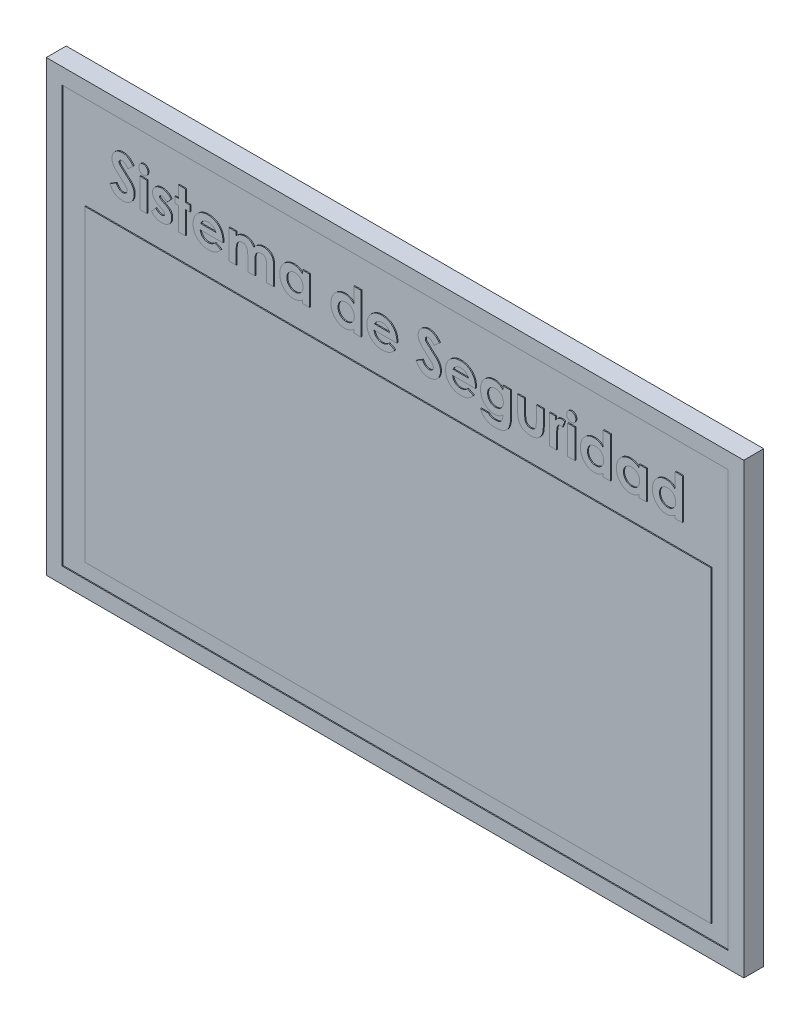
from build123d import *

# Parameters (mm, degrees)
CROQUIS1_W              = 700
CROQUIS1_H              = 450
SALIENTE_EXTRUIR1_DEPTH = 20
CROQUIS2_W              = 668
CROQUIS2_H              = 418
CORTAR_EXTRUIR1_DEPTH   = 1
CROQUIS3_W              = 7.123397436
CROQUIS3_H              = 29.002403846
SALIENTE_EXTRUIR2_DEPTH = 1
CROQUIS4_W              = 628.482790453
CROQUIS4_H              = 309.180406431
SALIENTE_EXTRUIR3_DEPTH = 1


with BuildPart() as part:
    # Croquis1 → Saliente-Extruir1 (new body)
    with BuildSketch(Plane.XY):
        Rectangle(CROQUIS1_W, CROQUIS1_H)
    extrude(amount=SALIENTE_EXTRUIR1_DEPTH)

    # Croquis2 → Cortar-Extruir1 (cut)
    with BuildSketch(Plane.XY.offset(20)):
        Rectangle(CROQUIS2_W, CROQUIS2_H)
    extrude(amount=-CORTAR_EXTRUIR1_DEPTH, mode=Mode.SUBTRACT)

    # Croquis3 → Saliente-Extruir2 (add)
    # profile 1 of 20: a face of its own
    with BuildSketch(Plane.XY.offset(19)):
        with BuildLine():
            Line((-262.746042649, 174.228143006), (-268.072690285, 169.354657929))
            add(Edge.make_bspline(
                [(-268.072690285, 169.354657929), (-268.30086103, 169.676516485), (-268.73891704, 170.294440029), (-269.448960142, 171.121854217), (-270.155797035, 171.827700095), (-270.865976134, 172.409028965), (-271.585792195, 172.862308821), (-272.313995723, 173.183235967), (-273.046458329, 173.387252398), (-273.538560134, 173.412657353), (-273.780948498, 173.42517075)],
                knots=[0, 0, 0, 0, 1.299362458, 2.494594718, 3.587462134, 4.587049575, 5.512617175, 6.380583204, 7.202344345, 8, 8, 8, 8], degree=3))
            add(Edge.make_bspline(
                [(-273.780948498, 173.42517075), (-274.007041412, 173.417241688), (-274.443567426, 173.401932751), (-275.065867643, 173.249763064), (-275.618354639, 172.987140532), (-276.10048921, 172.643739476), (-276.482410923, 172.230020818), (-276.787345794, 171.796136321), (-276.95904975, 171.317225963), (-276.981649369, 170.988291009), (-276.992837521, 170.825448695)],
                knots=[0, 0, 0, 0, 1.185010067, 2.2879431, 3.333075148, 4.379039566, 5.372662701, 6.27520591, 7.14612461, 8, 8, 8, 8], degree=3))
            add(Edge.make_bspline(
                [(-276.992837521, 170.825448695), (-276.985826473, 170.660258122), (-276.971707197, 170.327587264), (-276.835334213, 169.840016691), (-276.629781187, 169.363603484), (-276.433366878, 169.073588095), (-276.332969232, 168.92534603)],
                knots=[0, 0, 0, 0, 0.967525499, 1.948461899, 2.951351359, 4, 4, 4, 4], degree=3))
            add(Edge.make_bspline(
                [(-276.332969232, 168.92534603), (-276.24169691, 168.810119025), (-276.03160008, 168.544881676), (-275.630988455, 168.12478706), (-275.127904389, 167.610134384), (-274.502988149, 167.018621046), (-273.782181725, 166.328973911), (-272.93207481, 165.568303273), (-271.977137188, 164.713052044), (-271.29838965, 164.117486059), (-270.942719833, 163.805404123)],
                knots=[0, 0, 0, 0, 0.473873513, 1.090794244, 1.870441696, 2.795289791, 3.865433203, 5.087734844, 6.473946851, 8, 8, 8, 8], degree=3))
            add(Edge.make_bspline(
                [(-270.942719833, 163.805404123), (-270.608872546, 163.516476136), (-269.975299755, 162.968150844), (-269.07385149, 162.18989113), (-268.2816286, 161.489709841), (-267.587090205, 160.878115202), (-267.000764829, 160.348690183), (-266.520187559, 159.89890414), (-266.139488959, 159.537513578), (-265.923084095, 159.319233459), (-265.830728146, 159.2260772)],
                knots=[0, 0, 0, 0, 1.543621617, 2.929473131, 4.163658386, 5.240097082, 6.164993805, 6.925417477, 7.541396219, 8, 8, 8, 8], degree=3))
            add(Edge.make_bspline(
                [(-265.830728146, 159.2260772), (-265.480348929, 158.846891847), (-264.806797027, 158.117964435), (-263.931416996, 156.98835619), (-263.210950915, 155.88562821), (-262.653584693, 154.789030881), (-262.232639304, 153.682742485), (-261.935867229, 152.53963136), (-261.758128458, 151.347752711), (-261.738395305, 150.534441033), (-261.728414444, 150.123074897)],
                knots=[0, 0, 0, 0, 1.206664779, 2.319633467, 3.337109185, 4.282041471, 5.190008762, 6.099243693, 7.03861361, 8, 8, 8, 8], degree=3))
            add(Edge.make_bspline(
                [(-261.728414444, 150.123074897), (-261.735518565, 149.722249047), (-261.749457116, 148.93581381), (-261.920177633, 147.784982986), (-262.163615071, 146.683587941), (-262.540012055, 145.64361341), (-262.998762471, 144.647988527), (-263.573872373, 143.712221964), (-264.249260095, 142.826843379), (-265.023358124, 142.007679998), (-265.879602465, 141.264346007), (-266.798005896, 140.602612532), (-267.78754903, 140.056267259), (-268.839777364, 139.606390896), (-269.954127665, 139.259890107), (-271.129272407, 139.00379373), (-272.367009052, 138.850088721), (-273.213391206, 138.834020686), (-273.645794752, 138.825811776)],
                knots=[0, 0, 0, 0, 1.043214005, 2.046824704, 3.02475056, 3.976699089, 4.921714032, 5.875962561, 6.831408892, 7.817874052, 8.806269674, 9.781291748, 10.760897367, 11.74438705, 12.757449933, 13.795994037, 14.874007457, 16, 16, 16, 16], degree=3))
            add(Edge.make_bspline(
                [(-273.645794752, 138.825811776), (-273.985227854, 138.831833545), (-274.65750006, 138.843760102), (-275.648327656, 138.941130511), (-276.605083707, 139.098275991), (-277.526690512, 139.323512408), (-278.417300074, 139.608917497), (-279.276948967, 139.957528879), (-280.099702751, 140.374749901), (-280.891786771, 140.85200084), (-281.64935052, 141.406152045), (-282.381973095, 142.025874076), (-283.082377392, 142.720698536), (-283.753927311, 143.488982192), (-284.392326089, 144.332900637), (-285.018470808, 145.240700747), (-285.604533713, 146.229230059), (-285.966570839, 146.922691368), (-286.151491367, 147.27689601)],
                knots=[0, 0, 0, 0, 1.016823716, 2.013894106, 2.979844003, 3.91962641, 4.853723003, 5.779685073, 6.695824784, 7.614987388, 8.547259901, 9.504950863, 10.487499108, 11.500346958, 12.559593716, 13.656357062, 14.802919212, 16, 16, 16, 16], degree=3))
            Line((-286.151491367, 147.27689601), (-279.886717729, 151.037350237))
            add(Edge.make_bspline(
                [(-279.886717729, 151.037350237), (-279.655409787, 150.635281688), (-279.211972693, 149.864481916), (-278.460527082, 148.828814729), (-277.690709416, 147.941937219), (-276.884722201, 147.219525), (-276.052365938, 146.651918494), (-275.189620155, 146.246267507), (-274.295878702, 145.995170005), (-273.687102626, 145.964505201), (-273.383437481, 145.949209212)],
                knots=[0, 0, 0, 0, 1.283663364, 2.460892379, 3.537111102, 4.529833553, 5.449777664, 6.316464042, 7.160231139, 8, 8, 8, 8], degree=3))
            add(Edge.make_bspline(
                [(-273.383437481, 145.949209212), (-273.074566553, 145.961700746), (-272.475311969, 145.985936141), (-271.619952734, 146.209791185), (-270.835727, 146.561260025), (-270.157848067, 147.062757594), (-269.583862927, 147.641562009), (-269.160228947, 148.285508388), (-268.894099223, 148.982242824), (-268.865962859, 149.466240394), (-268.85181188, 149.709663438)],
                knots=[0, 0, 0, 0, 1.13588714, 2.203786484, 3.234766741, 4.283437687, 5.291419208, 6.222934724, 7.106237994, 8, 8, 8, 8], degree=3))
            add(Edge.make_bspline(
                [(-268.85181188, 149.709663438), (-268.86487973, 149.936128969), (-268.891425815, 150.396172013), (-269.086956102, 151.080182044), (-269.39262958, 151.763881002), (-269.754262859, 152.324669384), (-270.122270004, 152.794202295), (-270.474167838, 153.201031322), (-270.902686312, 153.650506175), (-271.406738891, 154.143192258), (-271.979665727, 154.683426813), (-272.621949435, 155.271156936), (-273.340944844, 155.901205428), (-273.849132218, 156.330388236), (-274.114857753, 156.554803162)],
                knots=[0, 0, 0, 0, 0.916159276, 1.861089862, 2.860218735, 3.940849679, 4.552606315, 5.27541173, 6.11797699, 7.06649574, 8.129236253, 9.306560635, 10.591630461, 12, 12, 12, 12], degree=3))
            add(Edge.make_bspline(
                [(-274.114857753, 156.554803162), (-274.620012572, 156.982212579), (-275.589557569, 157.802540618), (-276.959647657, 159.014139307), (-278.194221503, 160.1464893), (-279.282616001, 161.213588918), (-280.23869898, 162.195731304), (-281.055995431, 163.100893794), (-281.725526981, 163.936058478), (-282.430064569, 164.925255159), (-283.09951614, 166.130659283), (-283.678112272, 167.580900183), (-284.053481021, 169.030957068), (-284.095535869, 170.004445393), (-284.116234957, 170.48358922)],
                knots=[0, 0, 0, 0, 1.345494975, 2.582412109, 3.71882943, 4.751509156, 5.681369928, 6.505683931, 7.230279997, 7.856715994, 8.973648664, 10.023341002, 11.027102913, 12, 12, 12, 12], degree=3))
            add(Edge.make_bspline(
                [(-284.116234957, 170.48358922), (-284.107626234, 170.823372304), (-284.090666124, 171.492781479), (-283.939379332, 172.477050134), (-283.713275458, 173.426786686), (-283.38490772, 174.338526061), (-282.958726044, 175.21112627), (-282.441144954, 176.048859057), (-281.824127395, 176.844014121), (-281.128790261, 177.596064328), (-280.362706765, 178.283352634), (-279.544049195, 178.889953431), (-278.677451224, 179.402297284), (-277.76821426, 179.827323713), (-276.810704141, 180.152654445), (-275.811974798, 180.383265083), (-274.770593738, 180.520424937), (-274.062268819, 180.539070227), (-273.701446295, 180.548568186)],
                knots=[0, 0, 0, 0, 1.010766082, 1.991317756, 2.957454644, 3.913069143, 4.869106762, 5.843196583, 6.838735724, 7.860187025, 8.887984031, 9.89767229, 10.887916223, 11.879572884, 12.879850636, 13.892031539, 14.926195476, 16, 16, 16, 16], degree=3))
            add(Edge.make_bspline(
                [(-273.701446295, 180.548568186), (-273.233838162, 180.531462084), (-272.30231303, 180.49738491), (-270.925026256, 180.230912545), (-269.579750119, 179.811856682), (-268.495701396, 179.306311888), (-267.633144062, 178.816590407), (-266.972074439, 178.365716556), (-266.299400515, 177.849216327), (-265.609697592, 177.265462091), (-264.915781418, 176.603455151), (-264.197920637, 175.878955105), (-263.465896981, 175.085700577), (-262.990197669, 174.519003221), (-262.746042649, 174.228143006)],
                knots=[0, 0, 0, 0, 1.282922637, 2.555718331, 3.837320111, 5.142675274, 5.830281639, 6.55870424, 7.337177975, 8.157850921, 9.037902056, 9.96903443, 10.957596896, 12, 12, 12, 12], degree=3))
        make_face()
    # profile 2 of 20: a face of its own
    with BuildSketch(Plane.XY.offset(19)):
        with BuildLine():
            add(Edge.make_bspline(
                [(-252.585661038, 181.057382288), (-252.278642659, 181.042318805), (-251.675782491, 181.012740203), (-250.812103264, 180.724414635), (-250.01942077, 180.271896272), (-249.318667464, 179.651030293), (-248.73584639, 178.909602754), (-248.290549444, 178.07952533), (-248.042493065, 177.159826278), (-248.008041704, 176.524507793), (-247.990433675, 176.199797653)],
                knots=[0, 0, 0, 0, 0.989868614, 1.943702388, 2.910836514, 3.924849579, 4.949916355, 5.946401046, 6.950409252, 8, 8, 8, 8], degree=3))
            add(Edge.make_bspline(
                [(-247.990433675, 176.199797653), (-248.007411718, 175.877480447), (-248.040494245, 175.249430024), (-248.296258614, 174.342216315), (-248.723682888, 173.512542062), (-249.311224448, 172.782126098), (-250.004380674, 172.171259531), (-250.779742447, 171.710525971), (-251.635145123, 171.438239889), (-252.228650721, 171.406188681), (-252.530009496, 171.38991434)],
                knots=[0, 0, 0, 0, 1.05296456, 2.051751585, 3.055639087, 4.085634717, 5.099016424, 6.062201612, 7.016062274, 8, 8, 8, 8], degree=3))
            add(Edge.make_bspline(
                [(-252.530009496, 171.38991434), (-252.839707891, 171.404923974), (-253.447812918, 171.434395984), (-254.318576094, 171.723396168), (-255.121830945, 172.172350655), (-255.819544389, 172.805901889), (-256.409040065, 173.552597832), (-256.834886266, 174.402000176), (-257.101263598, 175.327988109), (-257.132882353, 175.972716092), (-257.149087521, 176.303150518)],
                knots=[0, 0, 0, 0, 0.989065327, 1.942068821, 2.907541208, 3.917690034, 4.939857478, 5.938239964, 6.943311734, 8, 8, 8, 8], degree=3))
            add(Edge.make_bspline(
                [(-257.149087521, 176.303150518), (-257.131451868, 176.619994584), (-257.096809174, 177.242389013), (-256.847266909, 178.14164046), (-256.412180608, 178.957762984), (-255.833557651, 179.685617997), (-255.138959317, 180.294902491), (-254.346752684, 180.733677575), (-253.488886046, 181.010094477), (-252.889844783, 181.041456928), (-252.585661038, 181.057382288)],
                knots=[0, 0, 0, 0, 1.038616768, 2.040212704, 3.031499824, 4.052181184, 5.074969369, 6.039807101, 7.004644834, 8, 8, 8, 8], degree=3))
        make_face()
    # profile 3 of 20: a face of its own
    with BuildSketch(Plane.XY.offset(19)):
        with Locations((-252.569760598, 154.344641904)):
            Rectangle(CROQUIS3_W, CROQUIS3_H)
    # profile 4 of 20: a face of its own
    with BuildSketch(Plane.XY.offset(19)):
        with BuildLine():
            Line((-224.584984957, 164.369869768), (-228.94170571, 159.687189981))
            add(Edge.make_bspline(
                [(-228.94170571, 159.687189981), (-229.159257649, 159.927922996), (-229.575352098, 160.388354063), (-230.212352483, 161.016024513), (-230.839866693, 161.538688582), (-231.446201045, 161.977748183), (-232.043739052, 162.314454413), (-232.627513831, 162.556707003), (-233.197805477, 162.71049255), (-233.575818888, 162.730399508), (-233.759539244, 162.740074596)],
                knots=[0, 0, 0, 0, 1.327646587, 2.539285, 3.655602211, 4.666613517, 5.598770349, 6.454635452, 7.248928967, 8, 8, 8, 8], degree=3))
            add(Edge.make_bspline(
                [(-233.759539244, 162.740074596), (-233.945445789, 162.734408801), (-234.301398991, 162.723560567), (-234.803728723, 162.630509926), (-235.245058997, 162.469422117), (-235.618502573, 162.249844421), (-235.918533751, 161.97934725), (-236.128599571, 161.669904869), (-236.269660701, 161.331141664), (-236.281593559, 161.090505072), (-236.287709316, 160.967175458)],
                knots=[0, 0, 0, 0, 1.295068245, 2.479652818, 3.543291146, 4.55379989, 5.481948265, 6.332409746, 7.145336708, 8, 8, 8, 8], degree=3))
            add(Edge.make_bspline(
                [(-236.287709316, 160.967175458), (-236.266988572, 160.780277788), (-236.223995436, 160.392486835), (-235.928692214, 159.942707185), (-235.537984725, 159.610913946), (-235.087611964, 159.302161284), (-234.477690652, 158.95694275), (-234.014988862, 158.720561534), (-233.759539244, 158.590059572)],
                knots=[0, 0, 0, 0, 0.916701701, 1.902049539, 2.5493345, 3.440293453, 4.586830489, 6, 6, 6, 6], degree=3))
            Line((-233.759539244, 158.590059572), (-231.183667849, 157.286223434))
            add(Edge.make_bspline(
                [(-231.183667849, 157.286223434), (-230.855967757, 157.119827972), (-230.22016802, 156.796989519), (-229.326293152, 156.276046322), (-228.500696073, 155.771110765), (-227.75993802, 155.253620022), (-227.099485076, 154.732564636), (-226.524028407, 154.20279206), (-226.019610291, 153.681097084), (-225.457113286, 152.981646746), (-224.894447461, 152.050035806), (-224.425358914, 150.838519191), (-224.126226852, 149.541251279), (-224.093131335, 148.643362689), (-224.076170854, 148.183221131)],
                knots=[0, 0, 0, 0, 1.076693506, 2.088987655, 3.030641824, 3.911722491, 4.735175175, 5.493635918, 6.202154166, 6.859459289, 8.120623445, 9.372284821, 10.653373066, 12, 12, 12, 12], degree=3))
            add(Edge.make_bspline(
                [(-224.076170854, 148.183221131), (-224.086389653, 147.872790069), (-224.106390554, 147.265194099), (-224.232832032, 146.370870757), (-224.459953669, 145.520501674), (-224.7588454, 144.700831289), (-225.161443605, 143.926681745), (-225.650217553, 143.194300231), (-226.21744932, 142.494070979), (-226.878134497, 141.849947457), (-227.601904059, 141.249631385), (-228.406496067, 140.744722459), (-229.256334962, 140.300791466), (-230.173872143, 139.954120887), (-231.146233421, 139.673063155), (-232.18175394, 139.478297189), (-233.276919964, 139.355725976), (-234.026856564, 139.341778673), (-234.411457312, 139.334625878)],
                knots=[0, 0, 0, 0, 0.976600749, 1.911466839, 2.833459288, 3.740827163, 4.650527853, 5.570709661, 6.506801416, 7.479409329, 8.468875524, 9.458587492, 10.461481786, 11.480119772, 12.538142914, 13.641687514, 14.790552763, 16, 16, 16, 16], degree=3))
            add(Edge.make_bspline(
                [(-234.411457312, 139.334625878), (-234.921020274, 139.350852627), (-235.921247503, 139.382704307), (-237.38200696, 139.60457856), (-238.761351688, 139.988646629), (-240.060416512, 140.526676866), (-241.287158018, 141.212274882), (-242.424056962, 142.062951939), (-243.490822524, 143.056544311), (-244.111477811, 143.81858339), (-244.428734957, 144.208110954)],
                knots=[0, 0, 0, 0, 1.056901255, 2.07460411, 3.05625841, 4.019970729, 4.984811261, 5.963335951, 6.958928997, 8, 8, 8, 8], degree=3))
            Line((-244.428734957, 144.208110954), (-240.111765305, 149.002093827))
            add(Edge.make_bspline(
                [(-240.111765305, 149.002093827), (-239.901427966, 148.780242023), (-239.483839555, 148.339793636), (-238.779954241, 147.759002887), (-238.035193727, 147.229654848), (-237.241267049, 146.785175211), (-236.447179948, 146.426277903), (-235.685318891, 146.157054717), (-234.970041994, 145.987866123), (-234.504987396, 145.961651653), (-234.284253787, 145.949209212)],
                knots=[0, 0, 0, 0, 1.087861918, 2.159761696, 3.243809206, 4.338405912, 5.394481878, 6.343674753, 7.213841449, 8, 8, 8, 8], degree=3))
            add(Edge.make_bspline(
                [(-234.284253787, 145.949209212), (-234.063639658, 145.955598344), (-233.639558416, 145.967880021), (-233.036829161, 146.095633563), (-232.502602448, 146.31040614), (-232.049558305, 146.608193767), (-231.67272831, 146.950008485), (-231.407210428, 147.338482916), (-231.231635948, 147.750413674), (-231.210296926, 148.038419981), (-231.19956829, 148.183221131)],
                knots=[0, 0, 0, 0, 1.255011871, 2.412479185, 3.488767498, 4.514443302, 5.48617286, 6.365347346, 7.178144445, 8, 8, 8, 8], degree=3))
            add(Edge.make_bspline(
                [(-231.19956829, 148.183221131), (-231.209141415, 148.319581897), (-231.228796887, 148.599556838), (-231.384409884, 149.012819883), (-231.628725354, 149.422016606), (-231.96757758, 149.828300722), (-232.405475423, 150.228375713), (-232.940851756, 150.619037114), (-233.561355431, 151.021127189), (-234.019694765, 151.261121119), (-234.260403126, 151.387159933)],
                knots=[0, 0, 0, 0, 0.704666567, 1.446816302, 2.258757648, 3.165368109, 4.175243826, 5.322435858, 6.59381024, 8, 8, 8, 8], degree=3))
            Line((-234.260403126, 151.387159933), (-236.621618571, 152.579692986))
            add(Edge.make_bspline(
                [(-236.621618571, 152.579692986), (-237.157236492, 152.866912743), (-238.185422081, 153.418266988), (-239.57514464, 154.363722347), (-240.751344157, 155.370178394), (-241.714979141, 156.432228101), (-242.482805403, 157.546891103), (-243.018415737, 158.72835924), (-243.355363559, 159.965431927), (-243.392433211, 160.811355651), (-243.411106752, 161.237482949)],
                knots=[0, 0, 0, 0, 1.255999728, 2.41104856, 3.467751088, 4.449286722, 5.368722015, 6.253902015, 7.120417131, 8, 8, 8, 8], degree=3))
            add(Edge.make_bspline(
                [(-243.411106752, 161.237482949), (-243.404630924, 161.513658613), (-243.391917821, 162.055836311), (-243.256579204, 162.852061834), (-243.052111597, 163.617436976), (-242.763585778, 164.353177222), (-242.393989241, 165.06001262), (-241.941169363, 165.734806296), (-241.399601781, 166.376331466), (-240.786624357, 166.982521639), (-240.106506663, 167.534605128), (-239.378680704, 168.023880199), (-238.605299251, 168.440651579), (-237.780015268, 168.772931371), (-236.913318557, 169.037405404), (-235.999488002, 169.217175987), (-235.042422419, 169.331510706), (-234.387942197, 169.346832863), (-234.053697397, 169.354657929)],
                knots=[0, 0, 0, 0, 0.959035663, 1.882742823, 2.798841253, 3.708806893, 4.623422363, 5.566085165, 6.527241613, 7.536786942, 8.55815439, 9.567237405, 10.580975912, 11.605536372, 12.654523293, 13.725718749, 14.838518481, 16, 16, 16, 16], degree=3))
            add(Edge.make_bspline(
                [(-234.053697397, 169.354657929), (-233.591601801, 169.339443836), (-232.674423556, 169.309246545), (-231.321766031, 169.064889882), (-230.015239169, 168.654182733), (-228.758505776, 168.088296965), (-227.567731366, 167.377139376), (-226.469101647, 166.513553879), (-225.455181472, 165.518805863), (-224.877930872, 164.756651524), (-224.584984957, 164.369869768)],
                knots=[0, 0, 0, 0, 0.996590028, 1.978055413, 2.954661574, 3.945146934, 4.945404762, 5.939399542, 6.954276554, 8, 8, 8, 8], degree=3))
        make_face()
    # profile 5 of 20: a face of its own
    with BuildSketch(Plane.XY.offset(19)):
        Polygon((-217.461587521, 180.548568186), (-210.338190085, 180.548568186), (-210.338190085, 168.845843827), (-205.758863162, 168.845843827), (-205.758863162, 162.740074596), (-210.338190085, 162.740074596), (-210.338190085, 139.843439981), (-217.461587521, 139.843439981), (-217.461587521, 162.740074596), (-221.023286239, 162.740074596), (-221.023286239, 168.845843827), (-217.461587521, 168.845843827), align=None)
    # profile 6 of 20: a face of its own
    with BuildSketch(Plane.XY.offset(19)):
        with BuildLine():
            Line((-172.709797156, 152.563792545), (-195.582581111, 152.563792545))
            add(Edge.make_bspline(
                [(-195.582581111, 152.563792545), (-195.535945351, 152.298023772), (-195.444302404, 151.775767164), (-195.245296487, 151.017144123), (-194.991335091, 150.302230575), (-194.68697835, 149.630070854), (-194.337357718, 148.997111517), (-193.929554215, 148.406321388), (-193.468740459, 147.858222295), (-192.957580751, 147.355196331), (-192.404595196, 146.904474167), (-191.812465567, 146.509613058), (-191.180580828, 146.185851104), (-190.516185295, 145.912953373), (-189.814314407, 145.696790723), (-189.073935187, 145.547707454), (-188.297010267, 145.459643421), (-187.767745277, 145.446905966), (-187.497207012, 145.440395109)],
                knots=[0, 0, 0, 0, 1.091296461, 2.144483647, 3.168565212, 4.157007626, 5.126487748, 6.090021542, 7.05641414, 8.019231907, 8.98705074, 9.938580405, 10.892824166, 11.854447369, 12.841318655, 13.858982407, 14.905600794, 16, 16, 16, 16], degree=3))
            add(Edge.make_bspline(
                [(-187.497207012, 145.440395109), (-187.170648961, 145.449016557), (-186.527559989, 145.465994728), (-185.585429856, 145.616565879), (-184.67425278, 145.843996986), (-183.802651706, 146.182206133), (-182.960530506, 146.603217067), (-182.161753076, 147.127744886), (-181.392493211, 147.740461177), (-180.92315404, 148.212742658), (-180.68386817, 148.453528623)],
                knots=[0, 0, 0, 0, 1.021034703, 2.010718019, 2.977989445, 3.954245119, 4.929443971, 5.918328161, 6.938689359, 8, 8, 8, 8], degree=3))
            Line((-180.68386817, 148.453528623), (-174.721202905, 145.615299957))
            add(Edge.make_bspline(
                [(-174.721202905, 145.615299957), (-174.908933941, 145.355884477), (-175.280916085, 144.841862245), (-175.888164451, 144.118500209), (-176.521866789, 143.443574083), (-177.182495711, 142.821522961), (-177.870889062, 142.254119441), (-178.585131897, 141.734451524), (-179.335662583, 141.276472085), (-180.107474395, 140.858024355), (-180.916522111, 140.499291056), (-181.760566738, 140.193375962), (-182.636033275, 139.91683132), (-183.553976971, 139.706119452), (-184.506754118, 139.539321656), (-185.496643946, 139.420873124), (-186.523515991, 139.347713141), (-187.221474937, 139.339040115), (-187.576709216, 139.334625878)],
                knots=[0, 0, 0, 0, 1.028154879, 2.037251081, 3.030720504, 4.000128189, 4.949298328, 5.894184978, 6.834267904, 7.770992897, 8.712077017, 9.673380525, 10.653304757, 11.658697181, 12.695551717, 13.758623199, 14.859225354, 16, 16, 16, 16], degree=3))
            add(Edge.make_bspline(
                [(-187.576709216, 139.334625878), (-188.12323132, 139.34576782), (-189.193563361, 139.36758867), (-190.759117459, 139.570117389), (-192.245959628, 139.905931836), (-193.658288195, 140.362419999), (-194.989998132, 140.965127383), (-196.241748507, 141.702288511), (-197.426046098, 142.559770526), (-198.506703999, 143.555569697), (-199.49121523, 144.639437892), (-200.355948682, 145.803438322), (-201.079545322, 147.039438551), (-201.673777434, 148.339258476), (-202.135635275, 149.706225123), (-202.468607988, 151.140935009), (-202.672724252, 152.642702891), (-202.694769822, 153.66557446), (-202.705978546, 154.185637497)],
                knots=[0, 0, 0, 0, 1.103565453, 2.161269334, 3.182010356, 4.179077853, 5.15417608, 6.128274628, 7.109042802, 8.101804412, 9.090965879, 10.063106201, 11.02526161, 11.978650795, 12.945248442, 13.93468508, 14.949922959, 16, 16, 16, 16], degree=3))
            add(Edge.make_bspline(
                [(-202.705978546, 154.185637497), (-202.694659504, 154.718916002), (-202.672389797, 155.768117514), (-202.470365428, 157.304561904), (-202.13471472, 158.770537665), (-201.671505843, 160.1680636), (-201.086288304, 161.501510571), (-200.35348514, 162.759212517), (-199.49164435, 163.945548069), (-198.510679801, 165.054967431), (-197.4254439, 166.056339612), (-196.272278224, 166.94876234), (-195.038225775, 167.692388194), (-193.73724475, 168.293237424), (-192.377656693, 168.781412256), (-190.943746664, 169.106251835), (-189.446424535, 169.324362168), (-188.4228881, 169.344448769), (-187.90266825, 169.354657929)],
                knots=[0, 0, 0, 0, 1.079208495, 2.12329425, 3.130605359, 4.119693003, 5.099659317, 6.073216462, 7.060498243, 8.06384408, 9.066070512, 10.045757761, 11.010926815, 11.975797609, 12.942977511, 13.929384301, 14.947594487, 16, 16, 16, 16], degree=3))
            add(Edge.make_bspline(
                [(-187.90266825, 169.354657929), (-187.353527934, 169.343343129), (-186.275347518, 169.321127684), (-184.698889818, 169.120243452), (-183.202175196, 168.782381249), (-181.778826807, 168.329840254), (-180.447021396, 167.711907848), (-179.177495157, 166.992887088), (-178.000698531, 166.116869948), (-176.904088119, 165.125943899), (-175.914173103, 164.026545788), (-175.048877695, 162.832262717), (-174.312617802, 161.554750189), (-173.715871852, 160.188827618), (-173.254488254, 158.738595637), (-172.921207314, 157.205937658), (-172.718647971, 155.585024185), (-172.69701262, 154.47509183), (-172.685946495, 153.907379784)],
                knots=[0, 0, 0, 0, 1.080001299, 2.120471247, 3.119684163, 4.095710327, 5.052285597, 6.002875087, 6.961153713, 7.931888285, 8.906493152, 9.865905668, 10.82813294, 11.801621613, 12.7925306, 13.817193356, 14.883530496, 16, 16, 16, 16], degree=3))
            Line((-172.685946495, 153.907379784), (-172.709797156, 152.563792545))
        make_face()
        with BuildLine():
            add(Edge.make_bspline(
                [(-179.809343931, 158.160747673), (-179.943766797, 158.523500537), (-180.211034473, 159.24474773), (-180.814781029, 160.239892867), (-181.615933391, 161.101728973), (-182.547731064, 161.864719312), (-183.61236825, 162.484009931), (-184.776296368, 162.932396452), (-186.024803589, 163.201254635), (-186.88370928, 163.232786977), (-187.322302164, 163.248888699)],
                knots=[0, 0, 0, 0, 0.954238005, 1.897273737, 2.851915805, 3.847685534, 4.862635127, 5.880135777, 6.917509367, 8, 8, 8, 8], degree=3))
            add(Edge.make_bspline(
                [(-187.322302164, 163.248888699), (-187.801317004, 163.233421034), (-188.737691274, 163.203184971), (-190.088347406, 162.881613339), (-191.362387538, 162.401677284), (-192.113489393, 161.906853021), (-192.489945393, 161.658844628)],
                knots=[0, 0, 0, 0, 1.044195649, 2.041185066, 3.018232172, 4, 4, 4, 4], degree=3))
            add(Edge.make_bspline(
                [(-192.489945393, 161.658844628), (-192.724825822, 161.469956004), (-193.225578888, 161.067255114), (-193.875908336, 160.26390507), (-194.516488256, 159.291228509), (-194.880693257, 158.552411942), (-195.073767008, 158.160747673)],
                knots=[0, 0, 0, 0, 0.82159062, 1.751589201, 2.808063854, 4, 4, 4, 4], degree=3))
            Line((-195.073767008, 158.160747673), (-179.809343931, 158.160747673))
        make_face(mode=Mode.SUBTRACT)
    # profile 7 of 20: a face of its own
    with BuildSketch(Plane.XY.offset(19)):
        with BuildLine():
            Line((-166.580177264, 168.845843827), (-159.456779829, 168.845843827))
            Line((-159.456779829, 168.845843827), (-159.456779829, 165.379547753))
            add(Edge.make_bspline(
                [(-159.456779829, 165.379547753), (-159.13993473, 165.69933551), (-158.516092772, 166.328971321), (-157.482264614, 167.138424758), (-156.403877161, 167.830607451), (-155.267862067, 168.390972903), (-154.076997979, 168.818852398), (-152.836928971, 169.132396182), (-151.541285534, 169.317377194), (-150.659127467, 169.342093266), (-150.210673558, 169.354657929)],
                knots=[0, 0, 0, 0, 1.041528618, 2.050684245, 3.032913108, 4.004406485, 4.976926473, 5.95771665, 6.961784757, 8, 8, 8, 8], degree=3))
            add(Edge.make_bspline(
                [(-150.210673558, 169.354657929), (-149.761627533, 169.340533432), (-148.877694957, 169.312729816), (-147.588043479, 169.058300676), (-146.366304754, 168.644939295), (-145.225920779, 168.055743436), (-144.158649527, 167.328117176), (-143.211771818, 166.424469052), (-142.359468092, 165.380771332), (-141.905157395, 164.591724635), (-141.6721369, 164.1870147)],
                knots=[0, 0, 0, 0, 1.023965777, 2.015643508, 2.987309376, 3.958410333, 4.93654923, 5.924956801, 6.93568961, 8, 8, 8, 8], degree=3))
            add(Edge.make_bspline(
                [(-141.6721369, 164.1870147), (-141.37197639, 164.592825601), (-140.782845542, 165.389318518), (-139.738557453, 166.429230327), (-138.609370466, 167.328211404), (-137.373437406, 168.061115284), (-136.063580379, 168.642928172), (-134.68553115, 169.056764811), (-133.251783577, 169.312304596), (-132.276039673, 169.340422866), (-131.782062781, 169.354657929)],
                knots=[0, 0, 0, 0, 1.041189987, 2.043563759, 3.033412161, 4.015238574, 5.00275396, 5.986226558, 6.980513695, 8, 8, 8, 8], degree=3))
            add(Edge.make_bspline(
                [(-131.782062781, 169.354657929), (-131.271843312, 169.339877011), (-130.278238325, 169.311092547), (-128.838362019, 169.027903811), (-127.489743618, 168.590334724), (-126.262187214, 167.953564608), (-125.152191694, 167.199285186), (-124.20634161, 166.308072574), (-123.421372462, 165.311024987), (-122.910256887, 164.380025819), (-122.579834398, 163.556915944), (-122.380322365, 162.840656125), (-122.193716884, 162.040861445), (-122.059659521, 161.146781542), (-121.934522887, 160.16682007), (-121.86187615, 159.09446192), (-121.81249741, 157.933319615), (-121.807252763, 157.129931575), (-121.804536239, 156.713807569)],
                knots=[0, 0, 0, 0, 1.321991808, 2.574456155, 3.791773975, 4.987670122, 6.148905103, 7.262530793, 8.344737981, 9.427709016, 10.004683293, 10.642050061, 11.354108788, 12.133887687, 12.985666279, 13.916212488, 14.92067847, 16, 16, 16, 16], degree=3))
            Line((-121.804536239, 156.713807569), (-121.804536239, 139.843439981))
            Line((-121.804536239, 139.843439981), (-128.927933675, 139.843439981))
            Line((-128.927933675, 139.843439981), (-128.927933675, 154.408243667))
            add(Edge.make_bspline(
                [(-128.927933675, 154.408243667), (-128.933862554, 154.797825091), (-128.945242501, 155.545591434), (-128.993623043, 156.618119488), (-129.101919393, 157.590809879), (-129.228856593, 158.469050401), (-129.410506172, 159.248184523), (-129.63199485, 159.930090446), (-129.888920371, 160.515749747), (-130.199150196, 161.005101389), (-130.546607964, 161.417212768), (-130.933104604, 161.770473833), (-131.354610303, 162.071875426), (-131.814946627, 162.32877745), (-132.326173207, 162.502525376), (-132.871031841, 162.638854198), (-133.453786214, 162.731695101), (-133.856702455, 162.737230004), (-134.063776022, 162.740074596)],
                knots=[0, 0, 0, 0, 1.669139205, 3.203761885, 4.596586177, 5.860166715, 7.002923539, 8.018877315, 8.928339525, 9.734594377, 10.491888885, 11.231098709, 11.971440889, 12.708030942, 13.480072485, 14.275788656, 15.113863979, 16, 16, 16, 16], degree=3))
            add(Edge.make_bspline(
                [(-134.063776022, 162.740074596), (-134.382873458, 162.729042571), (-135.009038677, 162.707394416), (-135.921489022, 162.500522057), (-136.780111521, 162.162307893), (-137.58168942, 161.702197478), (-138.308974541, 161.127528263), (-138.945164917, 160.445915779), (-139.470569446, 159.653431836), (-139.834267268, 158.9181657), (-140.061532722, 158.253337371), (-140.221847844, 157.683965297), (-140.346807109, 157.040089701), (-140.444613627, 156.328231551), (-140.538447561, 155.544366644), (-140.584481962, 154.689486203), (-140.631589204, 153.764777862), (-140.630975966, 153.125685435), (-140.630658034, 152.794348935)],
                knots=[0, 0, 0, 0, 1.129913425, 2.217230253, 3.297175357, 4.391411011, 5.481605898, 6.571841268, 7.681894157, 8.841607612, 9.468549532, 10.170608623, 10.93710061, 11.791434153, 12.717934886, 13.734733707, 14.825576123, 16, 16, 16, 16], degree=3))
            Line((-140.630658034, 152.794348935), (-140.630658034, 139.843439981))
            Line((-140.630658034, 139.843439981), (-147.75405547, 139.843439981))
            Line((-147.75405547, 139.843439981), (-147.75405547, 153.748375377))
            add(Edge.make_bspline(
                [(-147.75405547, 153.748375377), (-147.754653552, 154.058473745), (-147.755804069, 154.655002557), (-147.790386312, 155.516401577), (-147.836179959, 156.311785445), (-147.90037732, 157.043372623), (-147.974416334, 157.7102532), (-148.081271694, 158.308778874), (-148.193533107, 158.842247705), (-148.386006819, 159.448252377), (-148.65722703, 160.119806971), (-149.062433987, 160.831953224), (-149.552384544, 161.42820788), (-150.114695226, 161.91321107), (-150.750130424, 162.282744583), (-151.442592587, 162.55763159), (-152.20530385, 162.706007158), (-152.730303291, 162.728479142), (-153.001200902, 162.740074596)],
                knots=[0, 0, 0, 0, 1.256487322, 2.417074606, 3.49288742, 4.484586665, 5.393016842, 6.210437544, 6.947749329, 7.599905853, 8.784490193, 9.876739139, 10.906602197, 11.896672079, 12.869113195, 13.872201355, 14.902064413, 16, 16, 16, 16], degree=3))
            add(Edge.make_bspline(
                [(-153.001200902, 162.740074596), (-153.307291892, 162.729685337), (-153.913507657, 162.709109324), (-154.796553529, 162.488106114), (-155.640827274, 162.156097545), (-156.427755732, 161.683153957), (-157.144084259, 161.094961022), (-157.773905015, 160.393960646), (-158.296548342, 159.580984327), (-158.661860551, 158.825436918), (-158.885812203, 158.14402204), (-159.050437968, 157.559865684), (-159.170747954, 156.901810497), (-159.271128054, 156.177245272), (-159.364406457, 155.38531474), (-159.410631334, 154.522536299), (-159.457692028, 153.589866266), (-159.457091224, 152.94547893), (-159.456779829, 152.611493867)],
                knots=[0, 0, 0, 0, 1.07893236, 2.136834559, 3.195274846, 4.273923004, 5.364443877, 6.458052972, 7.587287137, 8.767908, 9.410170275, 10.118584836, 10.909717261, 11.770069756, 12.702352573, 13.724628867, 14.820678298, 16, 16, 16, 16], degree=3))
            Line((-159.456779829, 152.611493867), (-159.456779829, 139.843439981))
            Line((-159.456779829, 139.843439981), (-166.580177264, 139.843439981))
            Line((-166.580177264, 139.843439981), (-166.580177264, 168.845843827))
        make_face()
    # profile 8 of 20: a face of its own
    with BuildSketch(Plane.XY.offset(19)):
        with BuildLine():
            Line((-92.802132393, 168.845843827), (-85.678734957, 168.845843827))
            Line((-85.678734957, 168.845843827), (-85.678734957, 139.843439981))
            Line((-85.678734957, 139.843439981), (-92.802132393, 139.843439981))
            Line((-92.802132393, 139.843439981), (-92.802132393, 143.007627681))
            add(Edge.make_bspline(
                [(-92.802132393, 143.007627681), (-93.155094111, 142.699629029), (-93.840123104, 142.101864468), (-94.919507134, 141.326249752), (-96.002045247, 140.686467852), (-97.092939072, 140.17691646), (-98.208955187, 139.800665204), (-99.358128462, 139.528250505), (-100.557008215, 139.367600893), (-101.371990153, 139.345732044), (-101.785881391, 139.334625878)],
                knots=[0, 0, 0, 0, 1.129196829, 2.191548051, 3.199897424, 4.157751732, 5.089409408, 6.034969131, 7.002052659, 8, 8, 8, 8], degree=3))
            add(Edge.make_bspline(
                [(-101.785881391, 139.334625878), (-102.250492705, 139.345078179), (-103.168590991, 139.365732519), (-104.515798301, 139.583152772), (-105.816660895, 139.915962928), (-107.070122832, 140.386930898), (-108.273903554, 140.997213055), (-109.437215633, 141.730886286), (-110.540116356, 142.613706912), (-111.591786993, 143.60747753), (-112.55469032, 144.700632281), (-113.396469498, 145.877998327), (-114.106026785, 147.122877329), (-114.687329101, 148.43114194), (-115.144598441, 149.801831969), (-115.470566048, 151.239294827), (-115.662887311, 152.744043904), (-115.686691264, 153.769020044), (-115.698767008, 154.288990361)],
                knots=[0, 0, 0, 0, 0.980476535, 1.937477201, 2.874147792, 3.812856188, 4.758993464, 5.720109578, 6.712210464, 7.737600662, 8.772720504, 9.783789959, 10.789002326, 11.793715968, 12.802552247, 13.835794126, 14.902098527, 16, 16, 16, 16], degree=3))
            add(Edge.make_bspline(
                [(-115.698767008, 154.288990361), (-115.68609347, 154.827420308), (-115.661232913, 155.883610644), (-115.479379423, 157.433519741), (-115.159427144, 158.906624373), (-114.723149214, 160.304964998), (-114.161953414, 161.628783202), (-113.478454424, 162.880247818), (-112.663353886, 164.056087721), (-111.72409501, 165.136289286), (-110.709926119, 166.126346197), (-109.624944694, 166.988269251), (-108.486117472, 167.720512992), (-107.29223425, 168.318308044), (-106.043465522, 168.780253807), (-104.744741405, 169.117973881), (-103.390296482, 169.320617787), (-102.467637623, 169.343216983), (-102.000537341, 169.354657929)],
                knots=[0, 0, 0, 0, 1.136281865, 2.228943489, 3.287578264, 4.313574083, 5.316051562, 6.317280042, 7.318008486, 8.329309503, 9.333984563, 10.305318864, 11.248632312, 12.186624717, 13.117503092, 14.05354244, 15.014596925, 16, 16, 16, 16], degree=3))
            add(Edge.make_bspline(
                [(-102.000537341, 169.354657929), (-101.567851129, 169.345668783), (-100.711721078, 169.327882503), (-99.453333255, 169.134757529), (-98.232878564, 168.842669721), (-97.057014645, 168.426497172), (-95.916096674, 167.900994662), (-94.829749157, 167.242500845), (-93.774207264, 166.478691927), (-93.130160746, 165.88214098), (-92.802132393, 165.578303262)],
                knots=[0, 0, 0, 0, 1.017011718, 2.012299608, 2.98747302, 3.965332399, 4.941441765, 5.936729654, 6.94912688, 8, 8, 8, 8], degree=3))
            Line((-92.802132393, 165.578303262), (-92.802132393, 168.845843827))
        make_face()
        with BuildLine():
            add(Edge.make_bspline(
                [(-100.505895914, 162.740074596), (-100.789742304, 162.731365209), (-101.346062694, 162.714295379), (-102.164207959, 162.611619162), (-102.9461094, 162.430699091), (-103.686190557, 162.163428538), (-104.395481356, 161.837854064), (-105.063211109, 161.430077392), (-105.694890788, 160.948094032), (-106.286805419, 160.403572793), (-106.826422819, 159.805044394), (-107.291604512, 159.15192023), (-107.686933798, 158.461798289), (-108.02127963, 157.732603608), (-108.260595387, 156.955707563), (-108.450133369, 156.141223958), (-108.548491312, 155.282498878), (-108.566320506, 154.697304313), (-108.575369572, 154.400293446)],
                knots=[0, 0, 0, 0, 1.04836806, 2.054732945, 3.03993516, 4.00574415, 4.955904794, 5.917688631, 6.888591924, 7.88601754, 8.884115178, 9.859153345, 10.841239365, 11.818093293, 12.814750328, 13.83810466, 14.90274714, 16, 16, 16, 16], degree=3))
            add(Edge.make_bspline(
                [(-108.575369572, 154.400293446), (-108.566458733, 154.100588519), (-108.548900027, 153.510023434), (-108.448543017, 152.6440547), (-108.265825395, 151.817673403), (-107.999247273, 151.037560273), (-107.673693551, 150.293189002), (-107.277421459, 149.587994935), (-106.790670601, 148.934446784), (-106.250580168, 148.317079408), (-105.646522501, 147.7657943), (-105.011268522, 147.27630374), (-104.336141166, 146.8667473), (-103.628465087, 146.535741195), (-102.890622355, 146.265999043), (-102.113362659, 146.087352768), (-101.304300238, 145.973147585), (-100.752741021, 145.957243769), (-100.474095033, 145.949209212)],
                knots=[0, 0, 0, 0, 1.099136573, 2.165835871, 3.191374663, 4.196217796, 5.183857741, 6.167377911, 7.154730987, 8.166690795, 9.170734848, 10.148332609, 11.103258353, 12.059567475, 13.009337315, 13.978056681, 14.978520572, 16, 16, 16, 16], degree=3))
            add(Edge.make_bspline(
                [(-100.474095033, 145.949209212), (-100.184961673, 145.957967425), (-99.618103108, 145.975138285), (-98.786610216, 146.076877472), (-97.994205035, 146.258460902), (-97.244184394, 146.527261639), (-96.525092444, 146.850499135), (-95.843418341, 147.250307538), (-95.206559278, 147.731184878), (-94.611289857, 148.280628605), (-94.065840183, 148.884044348), (-93.594225396, 149.545733197), (-93.183431662, 150.244532526), (-92.86036129, 150.996964499), (-92.603798108, 151.78986507), (-92.419719944, 152.628155145), (-92.319592095, 153.512738505), (-92.302186956, 154.116501118), (-92.29331829, 154.424144107)],
                knots=[0, 0, 0, 0, 1.050008698, 2.058587853, 3.036635738, 3.995319155, 4.947022481, 5.895997462, 6.858296291, 7.838991643, 8.833936038, 9.806048392, 10.784806122, 11.771666913, 12.772873988, 13.80724452, 14.882696879, 16, 16, 16, 16], degree=3))
            add(Edge.make_bspline(
                [(-92.29331829, 154.424144107), (-92.302076754, 154.726495783), (-92.319184579, 155.317076437), (-92.420151768, 156.183190113), (-92.605536784, 157.005020001), (-92.856819471, 157.784076727), (-93.185637364, 158.518578989), (-93.596741917, 159.200382908), (-94.063183361, 159.853110434), (-94.61467195, 160.440224578), (-95.206716662, 160.98568991), (-95.85294177, 161.452025168), (-96.532987674, 161.853925837), (-97.251032588, 162.183901784), (-98.013725285, 162.425786663), (-98.807484634, 162.613069274), (-99.644694928, 162.714233754), (-100.214144311, 162.731320418), (-100.505895914, 162.740074596)],
                knots=[0, 0, 0, 0, 1.106611376, 2.161533483, 3.185006901, 4.184773755, 5.152708835, 6.122342771, 7.094156588, 8.082475533, 9.064254463, 10.03606828, 10.992420271, 11.951521816, 12.920622147, 13.915721683, 14.932141191, 16, 16, 16, 16], degree=3))
        make_face(mode=Mode.SUBTRACT)
    # profile 9 of 20: a face of its own
    with BuildSketch(Plane.XY.offset(19)):
        with BuildLine():
            Line((-41.411908034, 180.548568186), (-34.288510598, 180.548568186))
            Line((-34.288510598, 180.548568186), (-34.288510598, 139.843439981))
            Line((-34.288510598, 139.843439981), (-41.411908034, 139.843439981))
            Line((-41.411908034, 139.843439981), (-41.411908034, 143.007627681))
            add(Edge.make_bspline(
                [(-41.411908034, 143.007627681), (-41.764869752, 142.699629029), (-42.449898745, 142.101864468), (-43.529282775, 141.326249752), (-44.611820888, 140.686467852), (-45.702714713, 140.17691646), (-46.818730828, 139.800665204), (-47.967904103, 139.528250505), (-49.166783856, 139.367600893), (-49.981765794, 139.345732044), (-50.395657032, 139.334625878)],
                knots=[0, 0, 0, 0, 1.129196829, 2.191548051, 3.199897424, 4.157751732, 5.089409408, 6.034969131, 7.002052659, 8, 8, 8, 8], degree=3))
            add(Edge.make_bspline(
                [(-50.395657032, 139.334625878), (-50.860268346, 139.345078179), (-51.778366632, 139.365732519), (-53.125573942, 139.583152772), (-54.426436536, 139.915962928), (-55.679898473, 140.386930898), (-56.883679195, 140.997213055), (-58.046991274, 141.730886286), (-59.149891997, 142.613706912), (-60.201562634, 143.60747753), (-61.164465961, 144.700632281), (-62.006245139, 145.877998327), (-62.715802426, 147.122877329), (-63.297104742, 148.43114194), (-63.754374082, 149.801831969), (-64.080341689, 151.239294827), (-64.272662952, 152.744043904), (-64.296466905, 153.769020044), (-64.308542649, 154.288990361)],
                knots=[0, 0, 0, 0, 0.980476535, 1.937477201, 2.874147792, 3.812856188, 4.758993464, 5.720109578, 6.712210464, 7.737600662, 8.772720504, 9.783789959, 10.789002326, 11.793715968, 12.802552247, 13.835794126, 14.902098527, 16, 16, 16, 16], degree=3))
            add(Edge.make_bspline(
                [(-64.308542649, 154.288990361), (-64.295869111, 154.827420308), (-64.271008554, 155.883610644), (-64.089155064, 157.433519741), (-63.769202785, 158.906624373), (-63.332924855, 160.304964998), (-62.771729055, 161.628783202), (-62.088230065, 162.880247818), (-61.273129527, 164.056087721), (-60.333870651, 165.136289286), (-59.31970176, 166.126346197), (-58.234720335, 166.988269251), (-57.095893113, 167.720512992), (-55.902009891, 168.318308044), (-54.653241163, 168.780253807), (-53.354517046, 169.117973881), (-52.000072123, 169.320617787), (-51.077413264, 169.343216983), (-50.610312982, 169.354657929)],
                knots=[0, 0, 0, 0, 1.136281865, 2.228943489, 3.287578264, 4.313574083, 5.316051562, 6.317280042, 7.318008486, 8.329309503, 9.333984563, 10.305318864, 11.248632312, 12.186624717, 13.117503092, 14.05354244, 15.014596925, 16, 16, 16, 16], degree=3))
            add(Edge.make_bspline(
                [(-50.610312982, 169.354657929), (-50.177905716, 169.340939018), (-49.322820332, 169.313809869), (-48.059711929, 169.143038643), (-46.844361756, 168.821491325), (-45.662009426, 168.407201241), (-44.528010051, 167.8497081), (-43.436271166, 167.180025377), (-42.383916213, 166.389648269), (-41.740006818, 165.778437595), (-41.411908034, 165.467000177)],
                knots=[0, 0, 0, 0, 1.011899165, 2.001030639, 2.974036179, 3.948778736, 4.92769327, 5.924124564, 6.942254589, 8, 8, 8, 8], degree=3))
            Line((-41.411908034, 165.467000177), (-41.411908034, 180.548568186))
        make_face()
        with BuildLine():
            add(Edge.make_bspline(
                [(-49.115671555, 162.740074596), (-49.399517945, 162.731365209), (-49.955838335, 162.714295379), (-50.7739836, 162.611619162), (-51.555885041, 162.430699091), (-52.295966198, 162.163428538), (-53.005256997, 161.837854064), (-53.67298675, 161.430077392), (-54.304666429, 160.948094032), (-54.89658106, 160.403572793), (-55.43619846, 159.805044394), (-55.901380153, 159.15192023), (-56.296709439, 158.461798289), (-56.631055271, 157.732603608), (-56.870371028, 156.955707563), (-57.05990901, 156.141223958), (-57.158266953, 155.282498878), (-57.176096147, 154.697304313), (-57.185145213, 154.400293446)],
                knots=[0, 0, 0, 0, 1.04836806, 2.054732945, 3.03993516, 4.00574415, 4.955904794, 5.917688631, 6.888591924, 7.88601754, 8.884115178, 9.859153345, 10.841239365, 11.818093293, 12.814750328, 13.83810466, 14.90274714, 16, 16, 16, 16], degree=3))
            add(Edge.make_bspline(
                [(-57.185145213, 154.400293446), (-57.176234374, 154.100588519), (-57.158675668, 153.510023434), (-57.058318658, 152.6440547), (-56.875601036, 151.817673403), (-56.609022914, 151.037560273), (-56.283469192, 150.293189002), (-55.8871971, 149.587994935), (-55.400446242, 148.934446784), (-54.860355809, 148.317079408), (-54.256298142, 147.7657943), (-53.621044163, 147.27630374), (-52.945916807, 146.8667473), (-52.238240728, 146.535741195), (-51.500397996, 146.265999043), (-50.7231383, 146.087352768), (-49.914075879, 145.973147585), (-49.362516662, 145.957243769), (-49.083870674, 145.949209212)],
                knots=[0, 0, 0, 0, 1.099136573, 2.165835871, 3.191374663, 4.196217796, 5.183857741, 6.167377911, 7.154730987, 8.166690795, 9.170734848, 10.148332609, 11.103258353, 12.059567475, 13.009337315, 13.978056681, 14.978520572, 16, 16, 16, 16], degree=3))
            add(Edge.make_bspline(
                [(-49.083870674, 145.949209212), (-48.794737314, 145.957967425), (-48.227878749, 145.975138285), (-47.396385857, 146.076877472), (-46.603980676, 146.258460902), (-45.853960035, 146.527261639), (-45.134868085, 146.850499135), (-44.453193982, 147.250307538), (-43.816334919, 147.731184878), (-43.221065498, 148.280628605), (-42.675615824, 148.884044348), (-42.204001037, 149.545733197), (-41.793207303, 150.244532526), (-41.470136931, 150.996964499), (-41.21357375, 151.78986507), (-41.029495585, 152.628155145), (-40.929367736, 153.512738505), (-40.911962597, 154.116501118), (-40.903093931, 154.424144107)],
                knots=[0, 0, 0, 0, 1.050008698, 2.058587853, 3.036635738, 3.995319155, 4.947022481, 5.895997462, 6.858296291, 7.838991643, 8.833936038, 9.806048392, 10.784806122, 11.771666913, 12.772873988, 13.80724452, 14.882696879, 16, 16, 16, 16], degree=3))
            add(Edge.make_bspline(
                [(-40.903093931, 154.424144107), (-40.911852395, 154.726495783), (-40.92896022, 155.317076437), (-41.029927409, 156.183190113), (-41.215312425, 157.005020001), (-41.466595112, 157.784076727), (-41.795413005, 158.518578989), (-42.206517558, 159.200382908), (-42.672959002, 159.853110434), (-43.224447591, 160.440224578), (-43.816492303, 160.98568991), (-44.462717411, 161.452025168), (-45.142763315, 161.853925837), (-45.860808229, 162.183901784), (-46.623500926, 162.425786663), (-47.417260275, 162.613069274), (-48.254470569, 162.714233754), (-48.823919952, 162.731320418), (-49.115671555, 162.740074596)],
                knots=[0, 0, 0, 0, 1.106611376, 2.161533483, 3.185006901, 4.184773755, 5.152708835, 6.122342771, 7.094156588, 8.082475533, 9.064254463, 10.03606828, 10.992420271, 11.951521816, 12.920622147, 13.915721683, 14.932141191, 16, 16, 16, 16], degree=3))
        make_face(mode=Mode.SUBTRACT)
    # profile 10 of 20: a face of its own
    with BuildSketch(Plane.XY.offset(19)):
        with BuildLine():
            Line((1.813440023, 152.563792545), (-21.059343931, 152.563792545))
            add(Edge.make_bspline(
                [(-21.059343931, 152.563792545), (-21.012708172, 152.298023772), (-20.921065225, 151.775767164), (-20.722059308, 151.017144123), (-20.468097911, 150.302230575), (-20.16374117, 149.630070854), (-19.814120539, 148.997111517), (-19.406317035, 148.406321388), (-18.945503279, 147.858222295), (-18.434343572, 147.355196331), (-17.881358016, 146.904474167), (-17.289228388, 146.509613058), (-16.657343649, 146.185851104), (-15.992948116, 145.912953373), (-15.291077228, 145.696790723), (-14.550698008, 145.547707454), (-13.773773088, 145.459643421), (-13.244508097, 145.446905966), (-12.973969833, 145.440395109)],
                knots=[0, 0, 0, 0, 1.091296461, 2.144483647, 3.168565212, 4.157007626, 5.126487748, 6.090021542, 7.05641414, 8.019231907, 8.98705074, 9.938580405, 10.892824166, 11.854447369, 12.841318655, 13.858982407, 14.905600794, 16, 16, 16, 16], degree=3))
            add(Edge.make_bspline(
                [(-12.973969833, 145.440395109), (-12.647411781, 145.449016557), (-12.004322809, 145.465994728), (-11.062192677, 145.616565879), (-10.151015601, 145.843996986), (-9.279414527, 146.182206133), (-8.437293326, 146.603217067), (-7.638515897, 147.127744886), (-6.869256031, 147.740461177), (-6.39991686, 148.212742658), (-6.16063099, 148.453528623)],
                knots=[0, 0, 0, 0, 1.021034703, 2.010718019, 2.977989445, 3.954245119, 4.929443971, 5.918328161, 6.938689359, 8, 8, 8, 8], degree=3))
            Line((-6.16063099, 148.453528623), (-0.197965726, 145.615299957))
            add(Edge.make_bspline(
                [(-0.197965726, 145.615299957), (-0.385696762, 145.355884477), (-0.757678905, 144.841862245), (-1.364927271, 144.118500209), (-1.99862961, 143.443574083), (-2.659258532, 142.821522961), (-3.347651882, 142.254119441), (-4.061894718, 141.734451524), (-4.812425404, 141.276472085), (-5.584237215, 140.858024355), (-6.393284932, 140.499291056), (-7.237329558, 140.193375962), (-8.112796095, 139.91683132), (-9.030739791, 139.706119452), (-9.983516939, 139.539321656), (-10.973406766, 139.420873124), (-12.000278812, 139.347713141), (-12.698237758, 139.339040115), (-13.053472036, 139.334625878)],
                knots=[0, 0, 0, 0, 1.028154879, 2.037251081, 3.030720504, 4.000128189, 4.949298328, 5.894184978, 6.834267904, 7.770992897, 8.712077017, 9.673380525, 10.653304757, 11.658697181, 12.695551717, 13.758623199, 14.859225354, 16, 16, 16, 16], degree=3))
            add(Edge.make_bspline(
                [(-13.053472036, 139.334625878), (-13.59999414, 139.34576782), (-14.670326182, 139.36758867), (-16.235880279, 139.570117389), (-17.722722448, 139.905931836), (-19.135051016, 140.362419999), (-20.466760953, 140.965127383), (-21.718511328, 141.702288511), (-22.902808918, 142.559770526), (-23.983466819, 143.555569697), (-24.967978051, 144.639437892), (-25.832711502, 145.803438322), (-26.556308142, 147.039438551), (-27.150540254, 148.339258476), (-27.612398096, 149.706225123), (-27.945370809, 151.140935009), (-28.149487072, 152.642702891), (-28.171532642, 153.66557446), (-28.182741367, 154.185637497)],
                knots=[0, 0, 0, 0, 1.103565453, 2.161269334, 3.182010356, 4.179077853, 5.15417608, 6.128274628, 7.109042802, 8.101804412, 9.090965879, 10.063106201, 11.02526161, 11.978650795, 12.945248442, 13.93468508, 14.949922959, 16, 16, 16, 16], degree=3))
            add(Edge.make_bspline(
                [(-28.182741367, 154.185637497), (-28.171422325, 154.718916002), (-28.149152617, 155.768117514), (-27.947128249, 157.304561904), (-27.61147754, 158.770537665), (-27.148268664, 160.1680636), (-26.563051125, 161.501510571), (-25.83024796, 162.759212517), (-24.968407171, 163.945548069), (-23.987442622, 165.054967431), (-22.902206721, 166.056339612), (-21.749041045, 166.94876234), (-20.514988596, 167.692388194), (-19.21400757, 168.293237424), (-17.854419513, 168.781412256), (-16.420509485, 169.106251835), (-14.923187356, 169.324362168), (-13.89965092, 169.344448769), (-13.379431071, 169.354657929)],
                knots=[0, 0, 0, 0, 1.079208495, 2.12329425, 3.130605359, 4.119693003, 5.099659317, 6.073216462, 7.060498243, 8.06384408, 9.066070512, 10.045757761, 11.010926815, 11.975797609, 12.942977511, 13.929384301, 14.947594487, 16, 16, 16, 16], degree=3))
            add(Edge.make_bspline(
                [(-13.379431071, 169.354657929), (-12.830290755, 169.343343129), (-11.752110338, 169.321127684), (-10.175652639, 169.120243452), (-8.678938016, 168.782381249), (-7.255589628, 168.329840254), (-5.923784216, 167.711907848), (-4.654257977, 166.992887088), (-3.477461351, 166.116869948), (-2.380850939, 165.125943899), (-1.390935924, 164.026545788), (-0.525640516, 162.832262717), (0.210619377, 161.554750189), (0.807365328, 160.188827618), (1.268748925, 158.738595637), (1.602029866, 157.205937658), (1.804589208, 155.585024185), (1.82622456, 154.47509183), (1.837290684, 153.907379784)],
                knots=[0, 0, 0, 0, 1.080001299, 2.120471247, 3.119684163, 4.095710327, 5.052285597, 6.002875087, 6.961153713, 7.931888285, 8.906493152, 9.865905668, 10.82813294, 11.801621613, 12.7925306, 13.817193356, 14.883530496, 16, 16, 16, 16], degree=3))
            Line((1.837290684, 153.907379784), (1.813440023, 152.563792545))
        make_face()
        with BuildLine():
            add(Edge.make_bspline(
                [(-5.286106752, 158.160747673), (-5.420529618, 158.523500537), (-5.687797294, 159.24474773), (-6.291543849, 160.239892867), (-7.092696212, 161.101728973), (-8.024493885, 161.864719312), (-9.08913107, 162.484009931), (-10.253059188, 162.932396452), (-11.501566409, 163.201254635), (-12.3604721, 163.232786977), (-12.799064985, 163.248888699)],
                knots=[0, 0, 0, 0, 0.954238005, 1.897273737, 2.851915805, 3.847685534, 4.862635127, 5.880135777, 6.917509367, 8, 8, 8, 8], degree=3))
            add(Edge.make_bspline(
                [(-12.799064985, 163.248888699), (-13.278079825, 163.233421034), (-14.214454094, 163.203184971), (-15.565110227, 162.881613339), (-16.839150359, 162.401677284), (-17.590252213, 161.906853021), (-17.966708214, 161.658844628)],
                knots=[0, 0, 0, 0, 1.044195649, 2.041185066, 3.018232172, 4, 4, 4, 4], degree=3))
            add(Edge.make_bspline(
                [(-17.966708214, 161.658844628), (-18.201588642, 161.469956004), (-18.702341709, 161.067255114), (-19.352671157, 160.26390507), (-19.993251077, 159.291228509), (-20.357456078, 158.552411942), (-20.550529829, 158.160747673)],
                knots=[0, 0, 0, 0, 0.82159062, 1.751589201, 2.808063854, 4, 4, 4, 4], degree=3))
            Line((-20.550529829, 158.160747673), (-5.286106752, 158.160747673))
        make_face(mode=Mode.SUBTRACT)
    # profile 11 of 20: a face of its own
    with BuildSketch(Plane.XY.offset(19)):
        with BuildLine():
            Line((44.5776753, 174.228143006), (39.251027663, 169.354657929))
            add(Edge.make_bspline(
                [(39.251027663, 169.354657929), (39.022856919, 169.676516485), (38.584800909, 170.294440029), (37.874757807, 171.121854217), (37.167920914, 171.827700095), (36.457741815, 172.409028965), (35.737925754, 172.862308821), (35.009722226, 173.183235967), (34.27725962, 173.387252398), (33.785157814, 173.412657353), (33.54276945, 173.42517075)],
                knots=[0, 0, 0, 0, 1.299362458, 2.494594718, 3.587462134, 4.587049575, 5.512617175, 6.380583204, 7.202344345, 8, 8, 8, 8], degree=3))
            add(Edge.make_bspline(
                [(33.54276945, 173.42517075), (33.316676537, 173.417241688), (32.880150523, 173.401932751), (32.257850305, 173.249763064), (31.70536331, 172.987140532), (31.223228739, 172.643739476), (30.841307025, 172.230020818), (30.536372155, 171.796136321), (30.364668199, 171.317225963), (30.34206858, 170.988291009), (30.330880428, 170.825448695)],
                knots=[0, 0, 0, 0, 1.185010067, 2.2879431, 3.333075148, 4.379039566, 5.372662701, 6.27520591, 7.14612461, 8, 8, 8, 8], degree=3))
            add(Edge.make_bspline(
                [(30.330880428, 170.825448695), (30.337891476, 170.660258122), (30.352010751, 170.327587264), (30.488383735, 169.840016691), (30.693936762, 169.363603484), (30.89035107, 169.073588095), (30.990748717, 168.92534603)],
                knots=[0, 0, 0, 0, 0.967525499, 1.948461899, 2.951351359, 4, 4, 4, 4], degree=3))
            add(Edge.make_bspline(
                [(30.990748717, 168.92534603), (31.082021039, 168.810119025), (31.292117869, 168.544881676), (31.692729494, 168.12478706), (32.19581356, 167.610134384), (32.8207298, 167.018621046), (33.541536224, 166.328973911), (34.391643138, 165.568303273), (35.346580761, 164.713052044), (36.025328298, 164.117486059), (36.380998116, 163.805404123)],
                knots=[0, 0, 0, 0, 0.473873513, 1.090794244, 1.870441696, 2.795289791, 3.865433203, 5.087734844, 6.473946851, 8, 8, 8, 8], degree=3))
            add(Edge.make_bspline(
                [(36.380998116, 163.805404123), (36.714845403, 163.516476136), (37.348418193, 162.968150844), (38.249866459, 162.18989113), (39.042089349, 161.489709841), (39.736627744, 160.878115202), (40.32295312, 160.348690183), (40.803530389, 159.89890414), (41.18422899, 159.537513578), (41.400633854, 159.319233459), (41.492989803, 159.2260772)],
                knots=[0, 0, 0, 0, 1.543621617, 2.929473131, 4.163658386, 5.240097082, 6.164993805, 6.925417477, 7.541396219, 8, 8, 8, 8], degree=3))
            add(Edge.make_bspline(
                [(41.492989803, 159.2260772), (41.84336902, 158.846891847), (42.516920922, 158.117964435), (43.392300953, 156.98835619), (44.112767034, 155.88562821), (44.670133256, 154.789030881), (45.091078645, 153.682742485), (45.38785072, 152.53963136), (45.56558949, 151.347752711), (45.585322644, 150.534441033), (45.595303505, 150.123074897)],
                knots=[0, 0, 0, 0, 1.206664779, 2.319633467, 3.337109185, 4.282041471, 5.190008762, 6.099243693, 7.03861361, 8, 8, 8, 8], degree=3))
            add(Edge.make_bspline(
                [(45.595303505, 150.123074897), (45.588199383, 149.722249047), (45.574260833, 148.93581381), (45.403540315, 147.784982986), (45.160102878, 146.683587941), (44.783705893, 145.64361341), (44.324955478, 144.647988527), (43.749845575, 143.712221964), (43.074457854, 142.826843379), (42.300359824, 142.007679998), (41.444115484, 141.264346007), (40.525712052, 140.602612532), (39.536168919, 140.056267259), (38.483940585, 139.606390896), (37.369590284, 139.259890107), (36.194445542, 139.00379373), (34.956708897, 138.850088721), (34.110326742, 138.834020686), (33.677923196, 138.825811776)],
                knots=[0, 0, 0, 0, 1.043214005, 2.046824704, 3.02475056, 3.976699089, 4.921714032, 5.875962561, 6.831408892, 7.817874052, 8.806269674, 9.781291748, 10.760897367, 11.74438705, 12.757449933, 13.795994037, 14.874007457, 16, 16, 16, 16], degree=3))
            add(Edge.make_bspline(
                [(33.677923196, 138.825811776), (33.338490095, 138.831833545), (32.666217889, 138.843760102), (31.675390293, 138.941130511), (30.718634242, 139.098275991), (29.797027436, 139.323512408), (28.906417875, 139.608917497), (28.046768981, 139.957528879), (27.224015197, 140.374749901), (26.431931178, 140.85200084), (25.674367428, 141.406152045), (24.941744854, 142.025874076), (24.241340557, 142.720698536), (23.569790637, 143.488982192), (22.93139186, 144.332900637), (22.305247141, 145.240700747), (21.719184236, 146.229230059), (21.357147109, 146.922691368), (21.172226582, 147.27689601)],
                knots=[0, 0, 0, 0, 1.016823716, 2.013894106, 2.979844003, 3.91962641, 4.853723003, 5.779685073, 6.695824784, 7.614987388, 8.547259901, 9.504950863, 10.487499108, 11.500346958, 12.559593716, 13.656357062, 14.802919212, 16, 16, 16, 16], degree=3))
            Line((21.172226582, 147.27689601), (27.43700022, 151.037350237))
            add(Edge.make_bspline(
                [(27.43700022, 151.037350237), (27.668308162, 150.635281688), (28.111745255, 149.864481916), (28.863190866, 148.828814729), (29.633008532, 147.941937219), (30.438995748, 147.219525), (31.271352011, 146.651918494), (32.134097794, 146.246267507), (33.027839247, 145.995170005), (33.636615323, 145.964505201), (33.940280468, 145.949209212)],
                knots=[0, 0, 0, 0, 1.283663364, 2.460892379, 3.537111102, 4.529833553, 5.449777664, 6.316464042, 7.160231139, 8, 8, 8, 8], degree=3))
            add(Edge.make_bspline(
                [(33.940280468, 145.949209212), (34.249151396, 145.961700746), (34.84840598, 145.985936141), (35.703765215, 146.209791185), (36.487990949, 146.561260025), (37.165869882, 147.062757594), (37.739855022, 147.641562009), (38.163489002, 148.285508388), (38.429618726, 148.982242824), (38.45775509, 149.466240394), (38.471906069, 149.709663438)],
                knots=[0, 0, 0, 0, 1.13588714, 2.203786484, 3.234766741, 4.283437687, 5.291419208, 6.222934724, 7.106237994, 8, 8, 8, 8], degree=3))
            add(Edge.make_bspline(
                [(38.471906069, 149.709663438), (38.458838219, 149.936128969), (38.432292133, 150.396172013), (38.236761847, 151.080182044), (37.931088369, 151.763881002), (37.56945509, 152.324669384), (37.201447945, 152.794202295), (36.849550111, 153.201031322), (36.421031637, 153.650506175), (35.916979058, 154.143192258), (35.344052222, 154.683426813), (34.701768514, 155.271156936), (33.982773105, 155.901205428), (33.474585731, 156.330388236), (33.208860196, 156.554803162)],
                knots=[0, 0, 0, 0, 0.916159276, 1.861089862, 2.860218735, 3.940849679, 4.552606315, 5.27541173, 6.11797699, 7.06649574, 8.129236253, 9.306560635, 10.591630461, 12, 12, 12, 12], degree=3))
            add(Edge.make_bspline(
                [(33.208860196, 156.554803162), (32.703705377, 156.982212579), (31.73416038, 157.802540618), (30.364070292, 159.014139307), (29.129496446, 160.1464893), (28.041101948, 161.213588918), (27.085018969, 162.195731304), (26.267722518, 163.100893794), (25.598190967, 163.936058478), (24.89365338, 164.925255159), (24.224201809, 166.130659283), (23.645605677, 167.580900183), (23.270236928, 169.030957068), (23.22818208, 170.004445393), (23.207482992, 170.48358922)],
                knots=[0, 0, 0, 0, 1.345494975, 2.582412109, 3.71882943, 4.751509156, 5.681369928, 6.505683931, 7.230279997, 7.856715994, 8.973648664, 10.023341002, 11.027102913, 12, 12, 12, 12], degree=3))
            add(Edge.make_bspline(
                [(23.207482992, 170.48358922), (23.216091715, 170.823372304), (23.233051825, 171.492781479), (23.384338617, 172.477050134), (23.610442491, 173.426786686), (23.938810229, 174.338526061), (24.364991904, 175.21112627), (24.882572995, 176.048859057), (25.499590554, 176.844014121), (26.194927688, 177.596064328), (26.961011183, 178.283352634), (27.779668754, 178.889953431), (28.646266725, 179.402297284), (29.555503688, 179.827323713), (30.513013808, 180.152654445), (31.511743151, 180.383265083), (32.553124211, 180.520424937), (33.261449129, 180.539070227), (33.622271654, 180.548568186)],
                knots=[0, 0, 0, 0, 1.010766082, 1.991317756, 2.957454644, 3.913069143, 4.869106762, 5.843196583, 6.838735724, 7.860187025, 8.887984031, 9.89767229, 10.887916223, 11.879572884, 12.879850636, 13.892031539, 14.926195476, 16, 16, 16, 16], degree=3))
            add(Edge.make_bspline(
                [(33.622271654, 180.548568186), (34.089879787, 180.531462084), (35.021404919, 180.49738491), (36.398691693, 180.230912545), (37.74396783, 179.811856682), (38.828016553, 179.306311888), (39.690573887, 178.816590407), (40.351643509, 178.365716556), (41.024317433, 177.849216327), (41.714020357, 177.265462091), (42.407936531, 176.603455151), (43.125797312, 175.878955105), (43.857820968, 175.085700577), (44.33352028, 174.519003221), (44.5776753, 174.228143006)],
                knots=[0, 0, 0, 0, 1.282922637, 2.555718331, 3.837320111, 5.142675274, 5.830281639, 6.55870424, 7.337177975, 8.157850921, 9.037902056, 9.96903443, 10.957596896, 12, 12, 12, 12], degree=3))
        make_face()
    # profile 12 of 20: a face of its own
    with BuildSketch(Plane.XY.offset(19)):
        with BuildLine():
            Line((80.679625921, 152.563792545), (57.806841966, 152.563792545))
            add(Edge.make_bspline(
                [(57.806841966, 152.563792545), (57.853477726, 152.298023772), (57.945120673, 151.775767164), (58.14412659, 151.017144123), (58.398087986, 150.302230575), (58.702444727, 149.630070854), (59.052065359, 148.997111517), (59.459868862, 148.406321388), (59.920682618, 147.858222295), (60.431842326, 147.355196331), (60.984827881, 146.904474167), (61.57695751, 146.509613058), (62.208842249, 146.185851104), (62.873237782, 145.912953373), (63.575108669, 145.696790723), (64.31548789, 145.547707454), (65.09241281, 145.459643421), (65.6216778, 145.446905966), (65.892216065, 145.440395109)],
                knots=[0, 0, 0, 0, 1.091296461, 2.144483647, 3.168565212, 4.157007626, 5.126487748, 6.090021542, 7.05641414, 8.019231907, 8.98705074, 9.938580405, 10.892824166, 11.854447369, 12.841318655, 13.858982407, 14.905600794, 16, 16, 16, 16], degree=3))
            add(Edge.make_bspline(
                [(65.892216065, 145.440395109), (66.218774116, 145.449016557), (66.861863088, 145.465994728), (67.803993221, 145.616565879), (68.715170297, 145.843996986), (69.586771371, 146.182206133), (70.428892571, 146.603217067), (71.22767, 147.127744886), (71.996929866, 147.740461177), (72.466269037, 148.212742658), (72.705554907, 148.453528623)],
                knots=[0, 0, 0, 0, 1.021034703, 2.010718019, 2.977989445, 3.954245119, 4.929443971, 5.918328161, 6.938689359, 8, 8, 8, 8], degree=3))
            Line((72.705554907, 148.453528623), (78.668220171, 145.615299957))
            add(Edge.make_bspline(
                [(78.668220171, 145.615299957), (78.480489136, 145.355884477), (78.108506992, 144.841862245), (77.501258626, 144.118500209), (76.867556288, 143.443574083), (76.206927366, 142.821522961), (75.518534015, 142.254119441), (74.80429118, 141.734451524), (74.053760493, 141.276472085), (73.281948682, 140.858024355), (72.472900966, 140.499291056), (71.628856339, 140.193375962), (70.753389802, 139.91683132), (69.835446106, 139.706119452), (68.882668959, 139.539321656), (67.892779131, 139.420873124), (66.865907086, 139.347713141), (66.167948139, 139.339040115), (65.812713861, 139.334625878)],
                knots=[0, 0, 0, 0, 1.028154879, 2.037251081, 3.030720504, 4.000128189, 4.949298328, 5.894184978, 6.834267904, 7.770992897, 8.712077017, 9.673380525, 10.653304757, 11.658697181, 12.695551717, 13.758623199, 14.859225354, 16, 16, 16, 16], degree=3))
            add(Edge.make_bspline(
                [(65.812713861, 139.334625878), (65.266191757, 139.34576782), (64.195859716, 139.36758867), (62.630305618, 139.570117389), (61.143463449, 139.905931836), (59.731134882, 140.362419999), (58.399424945, 140.965127383), (57.14767457, 141.702288511), (55.963376979, 142.559770526), (54.882719078, 143.555569697), (53.898207847, 144.639437892), (53.033474395, 145.803438322), (52.309877755, 147.039438551), (51.715645643, 148.339258476), (51.253787802, 149.706225123), (50.920815088, 151.140935009), (50.716698825, 152.642702891), (50.694653255, 153.66557446), (50.68344453, 154.185637497)],
                knots=[0, 0, 0, 0, 1.103565453, 2.161269334, 3.182010356, 4.179077853, 5.15417608, 6.128274628, 7.109042802, 8.101804412, 9.090965879, 10.063106201, 11.02526161, 11.978650795, 12.945248442, 13.93468508, 14.949922959, 16, 16, 16, 16], degree=3))
            add(Edge.make_bspline(
                [(50.68344453, 154.185637497), (50.694763573, 154.718916002), (50.71703328, 155.768117514), (50.919057649, 157.304561904), (51.254708357, 158.770537665), (51.717917234, 160.1680636), (52.303134772, 161.501510571), (53.035937937, 162.759212517), (53.897778727, 163.945548069), (54.878743276, 165.054967431), (55.963979177, 166.056339612), (57.117144853, 166.94876234), (58.351197302, 167.692388194), (59.652178327, 168.293237424), (61.011766384, 168.781412256), (62.445676413, 169.106251835), (63.942998542, 169.324362168), (64.966534977, 169.344448769), (65.486754827, 169.354657929)],
                knots=[0, 0, 0, 0, 1.079208495, 2.12329425, 3.130605359, 4.119693003, 5.099659317, 6.073216462, 7.060498243, 8.06384408, 9.066070512, 10.045757761, 11.010926815, 11.975797609, 12.942977511, 13.929384301, 14.947594487, 16, 16, 16, 16], degree=3))
            add(Edge.make_bspline(
                [(65.486754827, 169.354657929), (66.035895143, 169.343343129), (67.114075559, 169.321127684), (68.690533259, 169.120243452), (70.187247881, 168.782381249), (71.61059627, 168.329840254), (72.942401681, 167.711907848), (74.21192792, 166.992887088), (75.388724546, 166.116869948), (76.485334958, 165.125943899), (77.475249974, 164.026545788), (78.340545382, 162.832262717), (79.076805275, 161.554750189), (79.673551225, 160.188827618), (80.134934823, 158.738595637), (80.468215763, 157.205937658), (80.670775105, 155.585024185), (80.692410457, 154.47509183), (80.703476582, 153.907379784)],
                knots=[0, 0, 0, 0, 1.080001299, 2.120471247, 3.119684163, 4.095710327, 5.052285597, 6.002875087, 6.961153713, 7.931888285, 8.906493152, 9.865905668, 10.82813294, 11.801621613, 12.7925306, 13.817193356, 14.883530496, 16, 16, 16, 16], degree=3))
            Line((80.703476582, 153.907379784), (80.679625921, 152.563792545))
        make_face()
        with BuildLine():
            add(Edge.make_bspline(
                [(73.580079146, 158.160747673), (73.44565628, 158.523500537), (73.178388604, 159.24474773), (72.574642048, 160.239892867), (71.773489686, 161.101728973), (70.841692013, 161.864719312), (69.777054827, 162.484009931), (68.613126709, 162.932396452), (67.364619488, 163.201254635), (66.505713797, 163.232786977), (66.067120913, 163.248888699)],
                knots=[0, 0, 0, 0, 0.954238005, 1.897273737, 2.851915805, 3.847685534, 4.862635127, 5.880135777, 6.917509367, 8, 8, 8, 8], degree=3))
            add(Edge.make_bspline(
                [(66.067120913, 163.248888699), (65.588106073, 163.233421034), (64.651731803, 163.203184971), (63.301075671, 162.881613339), (62.027035539, 162.401677284), (61.275933684, 161.906853021), (60.899477683, 161.658844628)],
                knots=[0, 0, 0, 0, 1.044195649, 2.041185066, 3.018232172, 4, 4, 4, 4], degree=3))
            add(Edge.make_bspline(
                [(60.899477683, 161.658844628), (60.664597255, 161.469956004), (60.163844189, 161.067255114), (59.513514741, 160.26390507), (58.872934821, 159.291228509), (58.508729819, 158.552411942), (58.315656069, 158.160747673)],
                knots=[0, 0, 0, 0, 0.82159062, 1.751589201, 2.808063854, 4, 4, 4, 4], degree=3))
            Line((58.315656069, 158.160747673), (73.580079146, 158.160747673))
        make_face(mode=Mode.SUBTRACT)
    # profile 13 of 20: a face of its own
    with BuildSketch(Plane.XY.offset(19)):
        with BuildLine():
            Line((108.17943812, 168.845843827), (115.811649659, 168.845843827))
            Line((115.811649659, 168.845843827), (115.811649659, 144.10475809))
            add(Edge.make_bspline(
                [(115.811649659, 144.10475809), (115.802477729, 143.513524936), (115.784766371, 142.3718305), (115.649659082, 140.717220365), (115.424350262, 139.183305758), (115.100138828, 137.767914303), (114.681404168, 136.476248229), (114.169275794, 135.304013388), (113.574166339, 134.244923402), (113.084853905, 133.626071703), (112.846217467, 133.324259292)],
                knots=[0, 0, 0, 0, 1.243822755, 2.401870584, 3.490053692, 4.503076575, 5.453444971, 6.342269266, 7.191528908, 8, 8, 8, 8], degree=3))
            add(Edge.make_bspline(
                [(112.846217467, 133.324259292), (112.503532247, 132.948372682), (111.819896742, 132.198502492), (110.614609028, 131.252192846), (109.294171936, 130.443398991), (107.845110185, 129.780553663), (106.269149764, 129.275676982), (104.570339162, 128.91207579), (102.747601388, 128.685607841), (101.488685174, 128.661780892), (100.841384735, 128.649529724)],
                knots=[0, 0, 0, 0, 0.916003385, 1.827369254, 2.751972866, 3.703651841, 4.69362366, 5.730423306, 6.83304546, 8, 8, 8, 8], degree=3))
            add(Edge.make_bspline(
                [(100.841384735, 128.649529724), (100.15715072, 128.660122492), (98.841192525, 128.680495111), (96.95018773, 128.879786029), (95.227664578, 129.207705484), (93.665534128, 129.669369604), (92.249242827, 130.265049834), (90.952083002, 130.979304801), (89.776545813, 131.833255401), (88.704862465, 132.793235854), (87.761887315, 133.880327825), (86.95667905, 135.084578234), (86.270683472, 136.394910388), (85.931965353, 137.331947762), (85.759816726, 137.80818357)],
                knots=[0, 0, 0, 0, 1.29412125, 2.488928388, 3.592140377, 4.607309753, 5.564519828, 6.493640275, 7.402258018, 8.307438948, 9.210158992, 10.116782752, 11.042881838, 12, 12, 12, 12], degree=3))
            Line((85.759816726, 137.80818357), (93.678236197, 137.80818357))
            add(Edge.make_bspline(
                [(93.678236197, 137.80818357), (93.861222406, 137.606733196), (94.229520226, 137.201272403), (94.880938698, 136.686770125), (95.601555179, 136.246381257), (96.397183576, 135.885773745), (97.271141299, 135.611564072), (98.217479184, 135.403238352), (99.240436086, 135.285835904), (99.945367275, 135.271501594), (100.308719971, 135.264113058)],
                knots=[0, 0, 0, 0, 0.888971165, 1.789239437, 2.70354581, 3.646217955, 4.638595249, 5.694475788, 6.811630907, 8, 8, 8, 8], degree=3))
            add(Edge.make_bspline(
                [(100.308719971, 135.264113058), (100.767902236, 135.272692617), (101.644900115, 135.289078824), (102.885658651, 135.468244172), (103.993680358, 135.735906728), (104.95297039, 136.138732342), (105.780596627, 136.622581327), (106.471038439, 137.184634839), (107.041142571, 137.803717386), (107.414050328, 138.386122802), (107.63564599, 138.914458947), (107.786539423, 139.370669606), (107.901129516, 139.896535188), (108.005436733, 140.482213401), (108.083408073, 141.135249726), (108.135065085, 141.854260705), (108.179859465, 142.636078529), (108.179581673, 143.179808807), (108.17943812, 143.460790241)],
                knots=[0, 0, 0, 0, 1.656375485, 3.163532, 4.516250129, 5.759907703, 6.905105653, 7.965920022, 8.961443813, 9.932912751, 10.442911961, 11.026787936, 11.664959534, 12.383728702, 13.174001396, 14.037595414, 14.985895623, 16, 16, 16, 16], degree=3))
            add(Edge.make_bspline(
                [(108.17943812, 143.460790241), (107.867364247, 143.15471263), (107.258385374, 142.557434824), (106.269803318, 141.795436935), (105.257814529, 141.166045436), (104.216603257, 140.665706755), (103.125462188, 140.2992175), (101.977982644, 140.036002866), (100.761096276, 139.875622), (99.924949724, 139.854321509), (99.497797495, 139.843439981)],
                knots=[0, 0, 0, 0, 1.082007397, 2.111422008, 3.08419067, 4.02964304, 4.965866572, 5.929243163, 6.942137121, 8, 8, 8, 8], degree=3))
            add(Edge.make_bspline(
                [(99.497797495, 139.843439981), (99.025317417, 139.854355166), (98.097198992, 139.875796461), (96.733984022, 140.084163929), (95.426100484, 140.408363381), (94.170026638, 140.859679338), (92.978579332, 141.458867292), (91.834803833, 142.17173382), (90.759897639, 143.035710977), (89.739031141, 144.002568741), (88.816348514, 145.077273454), (88.004444866, 146.231504865), (87.319989725, 147.457301109), (86.763370553, 148.753522675), (86.319887359, 150.114728079), (86.014676515, 151.548286561), (85.82816897, 153.051777627), (85.803963379, 154.076434822), (85.791617607, 154.599048955)],
                knots=[0, 0, 0, 0, 1.007560175, 1.979205489, 2.935124557, 3.879618859, 4.820364716, 5.775815361, 6.749909327, 7.75781854, 8.772289371, 9.766897274, 10.764314289, 11.762244114, 12.772609037, 13.814079916, 14.885097635, 16, 16, 16, 16], degree=3))
            add(Edge.make_bspline(
                [(85.791617607, 154.599048955), (85.802400415, 155.156226413), (85.823474069, 156.245160315), (86.030056021, 157.835687333), (86.351507534, 159.3462488), (86.810388009, 160.773684939), (87.41325398, 162.11189354), (88.141793388, 163.365120861), (88.989133727, 164.547698033), (89.659874388, 165.24924654), (89.997284174, 165.602153923)],
                knots=[0, 0, 0, 0, 1.104124469, 2.157873671, 3.173961494, 4.162551312, 5.124378318, 6.07778831, 7.033049473, 8, 8, 8, 8], degree=3))
            add(Edge.make_bspline(
                [(89.997284174, 165.602153923), (90.317481194, 165.903069794), (90.948445418, 166.496039549), (91.981331885, 167.25691816), (93.051062855, 167.909524692), (94.17231086, 168.434473068), (95.337141953, 168.852513217), (96.55245204, 169.144965482), (97.812198276, 169.325284801), (98.667719202, 169.344793812), (99.100286478, 169.354657929)],
                knots=[0, 0, 0, 0, 1.042068658, 2.053448347, 3.038272799, 4.011764631, 4.986555969, 5.970496305, 6.973845226, 8, 8, 8, 8], degree=3))
            add(Edge.make_bspline(
                [(99.100286478, 169.354657929), (99.506201907, 169.343259965), (100.310549048, 169.320674176), (101.502242047, 169.161321898), (102.656189106, 168.879802966), (103.785025138, 168.492773624), (104.900714883, 167.991421179), (106.002294222, 167.334302226), (107.112097328, 166.548573666), (107.816306171, 165.934636744), (108.17943812, 165.618054364)],
                knots=[0, 0, 0, 0, 0.968122651, 1.918396369, 2.861262201, 3.796768263, 4.761417965, 5.77287463, 6.85156174, 8, 8, 8, 8], degree=3))
            Line((108.17943812, 165.618054364), (108.17943812, 168.845843827))
        make_face()
        with BuildLine():
            add(Edge.make_bspline(
                [(100.801633633, 162.740074596), (100.523142284, 162.731100661), (99.974864601, 162.713433294), (99.169069483, 162.613893614), (98.404366199, 162.426002905), (97.6714348, 162.182033401), (96.979186474, 161.85384609), (96.326282988, 161.453431288), (95.704985366, 160.988660192), (95.135063633, 160.45076243), (94.606785273, 159.869551597), (94.163224326, 159.229895933), (93.767932453, 158.568218484), (93.460534377, 157.85789367), (93.206343131, 157.118198202), (93.050991939, 156.334079656), (92.926861534, 155.519870215), (92.919015159, 154.962633079), (92.915015043, 154.678551159)],
                knots=[0, 0, 0, 0, 1.059154978, 2.085203149, 3.079850876, 4.048488546, 5.017545358, 5.985239295, 6.956545898, 7.961752598, 8.960830395, 9.936516972, 10.916356752, 11.886198968, 12.873933111, 13.883774911, 14.921139228, 16, 16, 16, 16], degree=3))
            add(Edge.make_bspline(
                [(92.915015043, 154.678551159), (92.919345008, 154.383954242), (92.927843099, 153.805771498), (93.046824145, 152.963467237), (93.216786818, 152.157331369), (93.473529431, 151.397204251), (93.794947478, 150.673098222), (94.181045163, 149.985369116), (94.657661174, 149.350460213), (95.186926993, 148.754399028), (95.772437994, 148.215491523), (96.402688785, 147.746757795), (97.06470367, 147.341957974), (97.772793233, 147.026342661), (98.511636623, 146.770584803), (99.288644284, 146.584853484), (100.102030631, 146.484503904), (100.655627059, 146.466942429), (100.936787379, 146.458023314)],
                knots=[0, 0, 0, 0, 1.097915424, 2.154794285, 3.166904039, 4.167166757, 5.140698173, 6.119085138, 7.101657521, 8.095747232, 9.089148684, 10.06378348, 11.021581144, 11.977080764, 12.949256321, 13.934658686, 14.951055324, 16, 16, 16, 16], degree=3))
            add(Edge.make_bspline(
                [(100.936787379, 146.458023314), (101.212853021, 146.462351804), (101.754130485, 146.470838604), (102.543701259, 146.589891789), (103.298071158, 146.762032624), (104.015881583, 147.008194436), (104.693148848, 147.329489031), (105.338961102, 147.712905407), (105.939619391, 148.17688285), (106.506515304, 148.701441269), (107.018102683, 149.284736342), (107.469663082, 149.916728904), (107.840603591, 150.597533079), (108.156569024, 151.316370276), (108.390510485, 152.083380541), (108.568137566, 152.890947332), (108.672332579, 153.74298286), (108.682877177, 154.325808015), (108.688252223, 154.622899616)],
                knots=[0, 0, 0, 0, 1.047368431, 2.053558439, 3.025081491, 3.983010266, 4.928381778, 5.867249904, 6.829345556, 7.804873619, 8.796055618, 9.770545002, 10.747991713, 11.735078325, 12.747239243, 13.787476531, 14.872179528, 16, 16, 16, 16], degree=3))
            add(Edge.make_bspline(
                [(108.688252223, 154.622899616), (108.683037443, 154.917367001), (108.672855324, 155.49232935), (108.56718893, 156.333538897), (108.391105536, 157.130975925), (108.153923605, 157.891221738), (107.844822461, 158.609736307), (107.457210987, 159.279832233), (107.013960798, 159.913883126), (106.492049081, 160.49029153), (105.9295056, 161.023415312), (105.309315434, 161.474426647), (104.662494582, 161.872923983), (103.967203906, 162.188838575), (103.232079635, 162.437661033), (102.45594109, 162.607869756), (101.642746563, 162.727307699), (101.085645952, 162.735763693), (100.801633633, 162.740074596)],
                knots=[0, 0, 0, 0, 1.111098411, 2.169475416, 3.193737863, 4.190319778, 5.171520483, 6.139320596, 7.107999188, 8.085777416, 9.069626166, 10.027970922, 10.974971434, 11.932846196, 12.904000912, 13.89897495, 14.928888274, 16, 16, 16, 16], degree=3))
        make_face(mode=Mode.SUBTRACT)
    # profile 14 of 20: a face of its own
    with BuildSketch(Plane.XY.offset(19)):
        with BuildLine():
            Line((122.935047095, 168.845843827), (130.05844453, 168.845843827))
            Line((130.05844453, 168.845843827), (130.05844453, 154.92500799))
            add(Edge.make_bspline(
                [(130.05844453, 154.92500799), (130.059077092, 154.599015616), (130.060291132, 153.973356642), (130.094073897, 153.074787868), (130.141477795, 152.253087868), (130.200634653, 151.507287711), (130.288930054, 150.839181294), (130.390863373, 150.250044052), (130.506422872, 149.735631179), (130.69433721, 149.162249447), (130.988332587, 148.534793419), (131.432317646, 147.868675161), (131.97011305, 147.29267764), (132.59445282, 146.801689172), (133.311713, 146.41477948), (134.112011624, 146.152576685), (134.985279304, 145.976349144), (135.593508936, 145.95849428), (135.90980671, 145.949209212)],
                knots=[0, 0, 0, 0, 1.267339619, 2.432334223, 3.495366327, 4.467371443, 5.340232306, 6.114347373, 6.791623365, 7.387877112, 8.457231658, 9.474542289, 10.487879852, 11.508108106, 12.54995813, 13.638205937, 14.771795776, 16, 16, 16, 16], degree=3))
            add(Edge.make_bspline(
                [(135.90980671, 145.949209212), (136.225823798, 145.959806803), (136.835626412, 145.980256455), (137.71470428, 146.139728277), (138.516887919, 146.412988556), (139.25041627, 146.783633874), (139.893657536, 147.279679501), (140.4537014, 147.870753057), (140.925245192, 148.566389283), (141.151843729, 149.085313976), (141.268255228, 149.351903522)],
                knots=[0, 0, 0, 0, 1.116871431, 2.155171802, 3.144773418, 4.104381479, 5.046960687, 6.001340237, 6.973219418, 8, 8, 8, 8], degree=3))
            add(Edge.make_bspline(
                [(141.268255228, 149.351903522), (141.310974336, 149.470324989), (141.405271843, 149.731726721), (141.489198489, 150.182680678), (141.579528552, 150.714507856), (141.650982839, 151.338046444), (141.691414197, 152.049434808), (141.734732257, 152.849569544), (141.756807918, 153.737653764), (141.75967072, 154.360533868), (141.761168889, 154.686501379)],
                knots=[0, 0, 0, 0, 0.56094539, 1.238222264, 2.041156151, 2.969685991, 4.036367568, 5.220421584, 6.545382566, 8, 8, 8, 8], degree=3))
            Line((141.761168889, 154.686501379), (141.761168889, 168.845843827))
            Line((141.761168889, 168.845843827), (148.884566325, 168.845843827))
            Line((148.884566325, 168.845843827), (148.884566325, 156.658156026))
            add(Edge.make_bspline(
                [(148.884566325, 156.658156026), (148.883332916, 156.053864619), (148.880968097, 154.895255093), (148.813193837, 153.233267378), (148.719657678, 151.722188822), (148.599201099, 150.35785895), (148.425638053, 149.139711556), (148.212580164, 148.070603229), (147.97687012, 147.143469157), (147.760715221, 146.594135812), (147.660232391, 146.338770009)],
                knots=[0, 0, 0, 0, 1.388070971, 2.661352173, 3.82033814, 4.865898334, 5.806910977, 6.645039373, 7.370126333, 8, 8, 8, 8], degree=3))
            add(Edge.make_bspline(
                [(147.660232391, 146.338770009), (147.531439284, 146.063917507), (147.277212754, 145.521382282), (146.836082469, 144.750017344), (146.36051931, 144.019210177), (145.827895804, 143.346163262), (145.249084447, 142.72403616), (144.640446417, 142.13868641), (143.97457182, 141.613950336), (143.26872924, 141.136324999), (142.513069628, 140.712341013), (141.7127687, 140.336619388), (140.859177931, 140.030846412), (139.959698965, 139.771660687), (139.01018579, 139.57837256), (138.012551095, 139.431971552), (136.96570071, 139.356310952), (136.251768137, 139.341972673), (135.885956049, 139.334625878)],
                knots=[0, 0, 0, 0, 0.997311338, 1.968606903, 2.91805772, 3.860812155, 4.785445165, 5.709667791, 6.633356648, 7.568312411, 8.508286151, 9.478643871, 10.470653671, 11.485274776, 12.552984541, 13.653035246, 14.797438149, 16, 16, 16, 16], degree=3))
            add(Edge.make_bspline(
                [(135.885956049, 139.334625878), (135.490776199, 139.339335379), (134.71754324, 139.348550276), (133.587860688, 139.461396646), (132.511258029, 139.607405179), (131.499755464, 139.855646448), (130.539226889, 140.143246374), (129.640699715, 140.51030038), (128.800502335, 140.941851891), (128.016981547, 141.435342429), (127.296214052, 141.995294312), (126.62217278, 142.597503069), (126.01661868, 143.265928675), (125.459782874, 143.979929888), (124.957879964, 144.746078007), (124.510660836, 145.561648843), (124.117746671, 146.430352025), (123.908107474, 147.039188916), (123.801621113, 147.348447994)],
                knots=[0, 0, 0, 0, 1.211240017, 2.369985978, 3.478996442, 4.539426614, 5.559871561, 6.551301256, 7.510778031, 8.453136967, 9.386094087, 10.30661716, 11.221130616, 12.147659962, 13.080758632, 14.026335491, 14.997475882, 16, 16, 16, 16], degree=3))
            add(Edge.make_bspline(
                [(123.801621113, 147.348447994), (123.728972646, 147.588630431), (123.572470911, 148.106039394), (123.403496989, 148.965912698), (123.2683455, 149.956964826), (123.136874405, 151.080170619), (123.045157766, 152.337413131), (122.985210682, 153.726695694), (122.94470629, 155.250735048), (122.938361682, 156.31096835), (122.935047095, 156.864861756)],
                knots=[0, 0, 0, 0, 0.627914866, 1.352675004, 2.190563461, 3.132055958, 4.183353232, 5.345633452, 6.613289997, 8, 8, 8, 8], degree=3))
            Line((122.935047095, 156.864861756), (122.935047095, 168.845843827))
        make_face()
    # profile 15 of 20: a face of its own
    with BuildSketch(Plane.XY.offset(19)):
        with BuildLine():
            Line((154.990335556, 168.845843827), (161.096104787, 168.845843827))
            Line((161.096104787, 168.845843827), (161.096104787, 165.276194889))
            add(Edge.make_bspline(
                [(161.096104787, 165.276194889), (161.268825277, 165.593430572), (161.60641464, 166.213480876), (162.226594614, 167.045775619), (162.939082487, 167.746711029), (163.718276365, 168.330947811), (164.566537835, 168.786303015), (165.461151964, 169.110801003), (166.394465344, 169.321679731), (167.031140093, 169.343586043), (167.352928204, 169.354657929)],
                knots=[0, 0, 0, 0, 1.09866127, 2.147379032, 3.14564304, 4.131443017, 5.102343063, 6.064490016, 7.021754664, 8, 8, 8, 8], degree=3))
            add(Edge.make_bspline(
                [(167.352928204, 169.354657929), (167.586586526, 169.343716592), (168.062398303, 169.321436122), (168.787602408, 169.191919412), (169.523269934, 168.957728573), (170.00740256, 168.746870847), (170.254758633, 168.639138098)],
                knots=[0, 0, 0, 0, 0.931404136, 1.896671404, 2.925354185, 4, 4, 4, 4], degree=3))
            Line((170.254758633, 168.639138098), (168.044597375, 162.60492085))
            add(Edge.make_bspline(
                [(168.044597375, 162.60492085), (167.847040519, 162.700370771), (167.475709681, 162.879779878), (166.936601781, 163.091501107), (166.447339007, 163.220683054), (166.13715539, 163.239958132), (165.993440524, 163.248888699)],
                knots=[0, 0, 0, 0, 1.214386998, 2.282580073, 3.20428172, 4, 4, 4, 4], degree=3))
            add(Edge.make_bspline(
                [(165.993440524, 163.248888699), (165.857745742, 163.242970834), (165.590810727, 163.231329374), (165.196822114, 163.131566016), (164.825766883, 162.959527195), (164.459763905, 162.739128393), (164.127686755, 162.432757574), (163.795814722, 162.078078953), (163.503351316, 161.640181019), (163.194717606, 161.15277838), (162.931927037, 160.556197989), (162.706592215, 159.844003943), (162.505817081, 159.007955667), (162.367656377, 158.043614154), (162.234118509, 156.960311073), (162.154633491, 155.750095113), (162.095392301, 154.416793095), (162.091770099, 153.486100166), (162.089882331, 153.001054664)],
                knots=[0, 0, 0, 0, 0.544232178, 1.070598461, 1.618251235, 2.182094276, 2.777567932, 3.425210017, 4.127676488, 4.886675562, 5.738955394, 6.734782583, 7.883056018, 9.186093582, 10.642914445, 12.264202625, 14.053029461, 16, 16, 16, 16], degree=3))
            Line((162.089882331, 153.001054664), (162.113732992, 151.585915441))
            Line((162.113732992, 151.585915441), (162.113732992, 139.843439981))
            Line((162.113732992, 139.843439981), (154.990335556, 139.843439981))
            Line((154.990335556, 139.843439981), (154.990335556, 168.845843827))
        make_face()
    # profile 16 of 20: a face of its own
    with BuildSketch(Plane.XY.offset(19)):
        with BuildLine():
            add(Edge.make_bspline(
                [(176.853441526, 181.057382288), (177.160459906, 181.042318805), (177.763320073, 181.012740203), (178.6269993, 180.724414635), (179.419681794, 180.271896272), (180.1204351, 179.651030293), (180.703256175, 178.909602754), (181.14855312, 178.07952533), (181.396609499, 177.159826278), (181.43106086, 176.524507793), (181.448668889, 176.199797653)],
                knots=[0, 0, 0, 0, 0.989868614, 1.943702388, 2.910836514, 3.924849579, 4.949916355, 5.946401046, 6.950409252, 8, 8, 8, 8], degree=3))
            add(Edge.make_bspline(
                [(181.448668889, 176.199797653), (181.431690846, 175.877480447), (181.398608319, 175.249430024), (181.14284395, 174.342216315), (180.715419676, 173.512542062), (180.127878116, 172.782126098), (179.43472189, 172.171259531), (178.659360117, 171.710525971), (177.803957441, 171.438239889), (177.210451843, 171.406188681), (176.909093068, 171.38991434)],
                knots=[0, 0, 0, 0, 1.05296456, 2.051751585, 3.055639087, 4.085634717, 5.099016424, 6.062201612, 7.016062274, 8, 8, 8, 8], degree=3))
            add(Edge.make_bspline(
                [(176.909093068, 171.38991434), (176.599394673, 171.404923974), (175.991289646, 171.434395984), (175.12052647, 171.723396168), (174.317271619, 172.172350655), (173.619558175, 172.805901889), (173.030062499, 173.552597832), (172.604216299, 174.402000176), (172.337838966, 175.327988109), (172.306220211, 175.972716092), (172.290015043, 176.303150518)],
                knots=[0, 0, 0, 0, 0.989065327, 1.942068821, 2.907541208, 3.917690034, 4.939857478, 5.938239964, 6.943311734, 8, 8, 8, 8], degree=3))
            add(Edge.make_bspline(
                [(172.290015043, 176.303150518), (172.307650696, 176.619994584), (172.34229339, 177.242389013), (172.591835655, 178.14164046), (173.026921956, 178.957762984), (173.605544913, 179.685617997), (174.300143247, 180.294902491), (175.092349881, 180.733677575), (175.950216518, 181.010094477), (176.549257781, 181.041456928), (176.853441526, 181.057382288)],
                knots=[0, 0, 0, 0, 1.038616768, 2.040212704, 3.031499824, 4.052181184, 5.074969369, 6.039807101, 7.004644834, 8, 8, 8, 8], degree=3))
        make_face()
    # profile 17 of 20: a face of its own
    with BuildSketch(Plane.XY.offset(19)):
        with Locations((176.869341966, 154.344641904)):
            Rectangle(CROQUIS3_W, CROQUIS3_H)
    # profile 18 of 20: a face of its own
    with BuildSketch(Plane.XY.offset(19)):
        with BuildLine():
            Line((208.924630428, 180.548568186), (216.048027864, 180.548568186))
            Line((216.048027864, 180.548568186), (216.048027864, 139.843439981))
            Line((216.048027864, 139.843439981), (208.924630428, 139.843439981))
            Line((208.924630428, 139.843439981), (208.924630428, 143.007627681))
            add(Edge.make_bspline(
                [(208.924630428, 143.007627681), (208.571668709, 142.699629029), (207.886639717, 142.101864468), (206.807255687, 141.326249752), (205.724717573, 140.686467852), (204.633823748, 140.17691646), (203.517807633, 139.800665204), (202.368634358, 139.528250505), (201.169754606, 139.367600893), (200.354772667, 139.345732044), (199.940881429, 139.334625878)],
                knots=[0, 0, 0, 0, 1.129196829, 2.191548051, 3.199897424, 4.157751732, 5.089409408, 6.034969131, 7.002052659, 8, 8, 8, 8], degree=3))
            add(Edge.make_bspline(
                [(199.940881429, 139.334625878), (199.476270116, 139.345078179), (198.558171829, 139.365732519), (197.210964519, 139.583152772), (195.910101925, 139.915962928), (194.656639988, 140.386930898), (193.452859266, 140.997213055), (192.289547187, 141.730886286), (191.186646465, 142.613706912), (190.134975828, 143.60747753), (189.172072501, 144.700632281), (188.330293322, 145.877998327), (187.620736036, 147.122877329), (187.039433719, 148.43114194), (186.582164379, 149.801831969), (186.256196773, 151.239294827), (186.063875509, 152.744043904), (186.040071556, 153.769020044), (186.027995813, 154.288990361)],
                knots=[0, 0, 0, 0, 0.980476535, 1.937477201, 2.874147792, 3.812856188, 4.758993464, 5.720109578, 6.712210464, 7.737600662, 8.772720504, 9.783789959, 10.789002326, 11.793715968, 12.802552247, 13.835794126, 14.902098527, 16, 16, 16, 16], degree=3))
            add(Edge.make_bspline(
                [(186.027995813, 154.288990361), (186.040669351, 154.827420308), (186.065529908, 155.883610644), (186.247383398, 157.433519741), (186.567335676, 158.906624373), (187.003613606, 160.304964998), (187.564809407, 161.628783202), (188.248308396, 162.880247818), (189.063408935, 164.056087721), (190.00266781, 165.136289286), (191.016836702, 166.126346197), (192.101818127, 166.988269251), (193.240645348, 167.720512992), (194.434528571, 168.318308044), (195.683297299, 168.780253807), (196.982021415, 169.117973881), (198.336466338, 169.320617787), (199.259125197, 169.343216983), (199.72622548, 169.354657929)],
                knots=[0, 0, 0, 0, 1.136281865, 2.228943489, 3.287578264, 4.313574083, 5.316051562, 6.317280042, 7.318008486, 8.329309503, 9.333984563, 10.305318864, 11.248632312, 12.186624717, 13.117503092, 14.05354244, 15.014596925, 16, 16, 16, 16], degree=3))
            add(Edge.make_bspline(
                [(199.72622548, 169.354657929), (200.158632745, 169.340939018), (201.01371813, 169.313809869), (202.276826532, 169.143038643), (203.492176706, 168.821491325), (204.674529036, 168.407201241), (205.80852841, 167.8497081), (206.900267296, 167.180025377), (207.952622248, 166.389648269), (208.596531643, 165.778437595), (208.924630428, 165.467000177)],
                knots=[0, 0, 0, 0, 1.011899165, 2.001030639, 2.974036179, 3.948778736, 4.92769327, 5.924124564, 6.942254589, 8, 8, 8, 8], degree=3))
            Line((208.924630428, 165.467000177), (208.924630428, 180.548568186))
        make_face()
        with BuildLine():
            add(Edge.make_bspline(
                [(201.220866906, 162.740074596), (200.937020517, 162.731365209), (200.380700127, 162.714295379), (199.562554861, 162.611619162), (198.78065342, 162.430699091), (198.040572264, 162.163428538), (197.331281465, 161.837854064), (196.663551712, 161.430077392), (196.031872033, 160.948094032), (195.439957401, 160.403572793), (194.900340001, 159.805044394), (194.435158308, 159.15192023), (194.039829022, 158.461798289), (193.705483191, 157.732603608), (193.466167433, 156.955707563), (193.276629451, 156.141223958), (193.178271509, 155.282498878), (193.160442315, 154.697304313), (193.151393248, 154.400293446)],
                knots=[0, 0, 0, 0, 1.04836806, 2.054732945, 3.03993516, 4.00574415, 4.955904794, 5.917688631, 6.888591924, 7.88601754, 8.884115178, 9.859153345, 10.841239365, 11.818093293, 12.814750328, 13.83810466, 14.90274714, 16, 16, 16, 16], degree=3))
            add(Edge.make_bspline(
                [(193.151393248, 154.400293446), (193.160304088, 154.100588519), (193.177862793, 153.510023434), (193.278219803, 152.6440547), (193.460937426, 151.817673403), (193.727515548, 151.037560273), (194.05306927, 150.293189002), (194.449341362, 149.587994935), (194.93609222, 148.934446784), (195.476182653, 148.317079408), (196.08024032, 147.7657943), (196.715494299, 147.27630374), (197.390621654, 146.8667473), (198.098297733, 146.535741195), (198.836140465, 146.265999043), (199.613400161, 146.087352768), (200.422462583, 145.973147585), (200.9740218, 145.957243769), (201.252667788, 145.949209212)],
                knots=[0, 0, 0, 0, 1.099136573, 2.165835871, 3.191374663, 4.196217796, 5.183857741, 6.167377911, 7.154730987, 8.166690795, 9.170734848, 10.148332609, 11.103258353, 12.059567475, 13.009337315, 13.978056681, 14.978520572, 16, 16, 16, 16], degree=3))
            add(Edge.make_bspline(
                [(201.252667788, 145.949209212), (201.541801148, 145.957967425), (202.108659713, 145.975138285), (202.940152604, 146.076877472), (203.732557786, 146.258460902), (204.482578426, 146.527261639), (205.201670377, 146.850499135), (205.88334448, 147.250307538), (206.520203542, 147.731184878), (207.115472964, 148.280628605), (207.660922637, 148.884044348), (208.132537425, 149.545733197), (208.543331159, 150.244532526), (208.866401531, 150.996964499), (209.122964712, 151.78986507), (209.307042877, 152.628155145), (209.407170726, 153.512738505), (209.424575864, 154.116501118), (209.43344453, 154.424144107)],
                knots=[0, 0, 0, 0, 1.050008698, 2.058587853, 3.036635738, 3.995319155, 4.947022481, 5.895997462, 6.858296291, 7.838991643, 8.833936038, 9.806048392, 10.784806122, 11.771666913, 12.772873988, 13.80724452, 14.882696879, 16, 16, 16, 16], degree=3))
            add(Edge.make_bspline(
                [(209.43344453, 154.424144107), (209.424686066, 154.726495783), (209.407578241, 155.317076437), (209.306611052, 156.183190113), (209.121226037, 157.005020001), (208.869943349, 157.784076727), (208.541125457, 158.518578989), (208.130020904, 159.200382908), (207.66357946, 159.853110434), (207.11209087, 160.440224578), (206.520046158, 160.98568991), (205.873821051, 161.452025168), (205.193775147, 161.853925837), (204.475730233, 162.183901784), (203.713037536, 162.425786663), (202.919278186, 162.613069274), (202.082067893, 162.714233754), (201.51261851, 162.731320418), (201.220866906, 162.740074596)],
                knots=[0, 0, 0, 0, 1.106611376, 2.161533483, 3.185006901, 4.184773755, 5.152708835, 6.122342771, 7.094156588, 8.082475533, 9.064254463, 10.03606828, 10.992420271, 11.951521816, 12.920622147, 13.915721683, 14.932141191, 16, 16, 16, 16], degree=3))
        make_face(mode=Mode.SUBTRACT)
    # profile 19 of 20: a face of its own
    with BuildSketch(Plane.XY.offset(19)):
        with BuildLine():
            Line((245.05043171, 168.845843827), (252.173829146, 168.845843827))
            Line((252.173829146, 168.845843827), (252.173829146, 139.843439981))
            Line((252.173829146, 139.843439981), (245.05043171, 139.843439981))
            Line((245.05043171, 139.843439981), (245.05043171, 143.007627681))
            add(Edge.make_bspline(
                [(245.05043171, 143.007627681), (244.697469992, 142.699629029), (244.012440999, 142.101864468), (242.933056969, 141.326249752), (241.850518855, 140.686467852), (240.75962503, 140.17691646), (239.643608915, 139.800665204), (238.49443564, 139.528250505), (237.295555888, 139.367600893), (236.480573949, 139.345732044), (236.066682712, 139.334625878)],
                knots=[0, 0, 0, 0, 1.129196829, 2.191548051, 3.199897424, 4.157751732, 5.089409408, 6.034969131, 7.002052659, 8, 8, 8, 8], degree=3))
            add(Edge.make_bspline(
                [(236.066682712, 139.334625878), (235.602071398, 139.345078179), (234.683973111, 139.365732519), (233.336765801, 139.583152772), (232.035903207, 139.915962928), (230.78244127, 140.386930898), (229.578660548, 140.997213055), (228.41534847, 141.730886286), (227.312447747, 142.613706912), (226.26077711, 143.60747753), (225.297873783, 144.700632281), (224.456094605, 145.877998327), (223.746537318, 147.122877329), (223.165235001, 148.43114194), (222.707965662, 149.801831969), (222.381998055, 151.239294827), (222.189676791, 152.744043904), (222.165872838, 153.769020044), (222.153797095, 154.288990361)],
                knots=[0, 0, 0, 0, 0.980476535, 1.937477201, 2.874147792, 3.812856188, 4.758993464, 5.720109578, 6.712210464, 7.737600662, 8.772720504, 9.783789959, 10.789002326, 11.793715968, 12.802552247, 13.835794126, 14.902098527, 16, 16, 16, 16], degree=3))
            add(Edge.make_bspline(
                [(222.153797095, 154.288990361), (222.166470633, 154.827420308), (222.19133119, 155.883610644), (222.37318468, 157.433519741), (222.693136958, 158.906624373), (223.129414889, 160.304964998), (223.690610689, 161.628783202), (224.374109678, 162.880247818), (225.189210217, 164.056087721), (226.128469092, 165.136289286), (227.142637984, 166.126346197), (228.227619409, 166.988269251), (229.36644663, 167.720512992), (230.560329853, 168.318308044), (231.809098581, 168.780253807), (233.107822697, 169.117973881), (234.46226762, 169.320617787), (235.384926479, 169.343216983), (235.852026762, 169.354657929)],
                knots=[0, 0, 0, 0, 1.136281865, 2.228943489, 3.287578264, 4.313574083, 5.316051562, 6.317280042, 7.318008486, 8.329309503, 9.333984563, 10.305318864, 11.248632312, 12.186624717, 13.117503092, 14.05354244, 15.014596925, 16, 16, 16, 16], degree=3))
            add(Edge.make_bspline(
                [(235.852026762, 169.354657929), (236.284712974, 169.345668783), (237.140843025, 169.327882503), (238.399230847, 169.134757529), (239.619685538, 168.842669721), (240.795549457, 168.426497172), (241.936467428, 167.900994662), (243.022814945, 167.242500845), (244.078356839, 166.478691927), (244.722403357, 165.88214098), (245.05043171, 165.578303262)],
                knots=[0, 0, 0, 0, 1.017011718, 2.012299608, 2.98747302, 3.965332399, 4.941441765, 5.936729654, 6.94912688, 8, 8, 8, 8], degree=3))
            Line((245.05043171, 165.578303262), (245.05043171, 168.845843827))
        make_face()
        with BuildLine():
            add(Edge.make_bspline(
                [(237.346668188, 162.740074596), (237.062821799, 162.731365209), (236.506501409, 162.714295379), (235.688356144, 162.611619162), (234.906454702, 162.430699091), (234.166373546, 162.163428538), (233.457082747, 161.837854064), (232.789352994, 161.430077392), (232.157673315, 160.948094032), (231.565758683, 160.403572793), (231.026141283, 159.805044394), (230.56095959, 159.15192023), (230.165630304, 158.461798289), (229.831284473, 157.732603608), (229.591968715, 156.955707563), (229.402430733, 156.141223958), (229.304072791, 155.282498878), (229.286243597, 154.697304313), (229.27719453, 154.400293446)],
                knots=[0, 0, 0, 0, 1.04836806, 2.054732945, 3.03993516, 4.00574415, 4.955904794, 5.917688631, 6.888591924, 7.88601754, 8.884115178, 9.859153345, 10.841239365, 11.818093293, 12.814750328, 13.83810466, 14.90274714, 16, 16, 16, 16], degree=3))
            add(Edge.make_bspline(
                [(229.27719453, 154.400293446), (229.28610537, 154.100588519), (229.303664075, 153.510023434), (229.404021085, 152.6440547), (229.586738708, 151.817673403), (229.85331683, 151.037560273), (230.178870552, 150.293189002), (230.575142644, 149.587994935), (231.061893502, 148.934446784), (231.601983935, 148.317079408), (232.206041602, 147.7657943), (232.841295581, 147.27630374), (233.516422936, 146.8667473), (234.224099015, 146.535741195), (234.961941747, 146.265999043), (235.739201443, 146.087352768), (236.548263865, 145.973147585), (237.099823082, 145.957243769), (237.37846907, 145.949209212)],
                knots=[0, 0, 0, 0, 1.099136573, 2.165835871, 3.191374663, 4.196217796, 5.183857741, 6.167377911, 7.154730987, 8.166690795, 9.170734848, 10.148332609, 11.103258353, 12.059567475, 13.009337315, 13.978056681, 14.978520572, 16, 16, 16, 16], degree=3))
            add(Edge.make_bspline(
                [(237.37846907, 145.949209212), (237.66760243, 145.957967425), (238.234460995, 145.975138285), (239.065953886, 146.076877472), (239.858359068, 146.258460902), (240.608379708, 146.527261639), (241.327471659, 146.850499135), (242.009145762, 147.250307538), (242.646004824, 147.731184878), (243.241274246, 148.280628605), (243.786723919, 148.884044348), (244.258338707, 149.545733197), (244.669132441, 150.244532526), (244.992202813, 150.996964499), (245.248765994, 151.78986507), (245.432844159, 152.628155145), (245.532972008, 153.512738505), (245.550377147, 154.116501118), (245.559245813, 154.424144107)],
                knots=[0, 0, 0, 0, 1.050008698, 2.058587853, 3.036635738, 3.995319155, 4.947022481, 5.895997462, 6.858296291, 7.838991643, 8.833936038, 9.806048392, 10.784806122, 11.771666913, 12.772873988, 13.80724452, 14.882696879, 16, 16, 16, 16], degree=3))
            add(Edge.make_bspline(
                [(245.559245813, 154.424144107), (245.550487348, 154.726495783), (245.533379523, 155.317076437), (245.432412334, 156.183190113), (245.247027319, 157.005020001), (244.995744631, 157.784076727), (244.666926739, 158.518578989), (244.255822186, 159.200382908), (243.789380742, 159.853110434), (243.237892152, 160.440224578), (242.64584744, 160.98568991), (241.999622333, 161.452025168), (241.319576429, 161.853925837), (240.601531515, 162.183901784), (239.838838818, 162.425786663), (239.045079468, 162.613069274), (238.207869175, 162.714233754), (237.638419792, 162.731320418), (237.346668188, 162.740074596)],
                knots=[0, 0, 0, 0, 1.106611376, 2.161533483, 3.185006901, 4.184773755, 5.152708835, 6.122342771, 7.094156588, 8.082475533, 9.064254463, 10.03606828, 10.992420271, 11.951521816, 12.920622147, 13.915721683, 14.932141191, 16, 16, 16, 16], degree=3))
        make_face(mode=Mode.SUBTRACT)
    # profile 20 of 20: a face of its own
    with BuildSketch(Plane.XY.offset(19)):
        with BuildLine():
            Line((281.176232992, 180.548568186), (288.299630428, 180.548568186))
            Line((288.299630428, 180.548568186), (288.299630428, 139.843439981))
            Line((288.299630428, 139.843439981), (281.176232992, 139.843439981))
            Line((281.176232992, 139.843439981), (281.176232992, 143.007627681))
            add(Edge.make_bspline(
                [(281.176232992, 143.007627681), (280.823271274, 142.699629029), (280.138242281, 142.101864468), (279.058858251, 141.326249752), (277.976320137, 140.686467852), (276.885426313, 140.17691646), (275.769410197, 139.800665204), (274.620236922, 139.528250505), (273.42135717, 139.367600893), (272.606375231, 139.345732044), (272.192483994, 139.334625878)],
                knots=[0, 0, 0, 0, 1.129196829, 2.191548051, 3.199897424, 4.157751732, 5.089409408, 6.034969131, 7.002052659, 8, 8, 8, 8], degree=3))
            add(Edge.make_bspline(
                [(272.192483994, 139.334625878), (271.72787268, 139.345078179), (270.809774393, 139.365732519), (269.462567083, 139.583152772), (268.16170449, 139.915962928), (266.908242552, 140.386930898), (265.70446183, 140.997213055), (264.541149752, 141.730886286), (263.438249029, 142.613706912), (262.386578392, 143.60747753), (261.423675065, 144.700632281), (260.581895887, 145.877998327), (259.8723386, 147.122877329), (259.291036283, 148.43114194), (258.833766944, 149.801831969), (258.507799337, 151.239294827), (258.315478074, 152.744043904), (258.29167412, 153.769020044), (258.279598377, 154.288990361)],
                knots=[0, 0, 0, 0, 0.980476535, 1.937477201, 2.874147792, 3.812856188, 4.758993464, 5.720109578, 6.712210464, 7.737600662, 8.772720504, 9.783789959, 10.789002326, 11.793715968, 12.802552247, 13.835794126, 14.902098527, 16, 16, 16, 16], degree=3))
            add(Edge.make_bspline(
                [(258.279598377, 154.288990361), (258.292271915, 154.827420308), (258.317132472, 155.883610644), (258.498985962, 157.433519741), (258.818938241, 158.906624373), (259.255216171, 160.304964998), (259.816411971, 161.628783202), (260.49991096, 162.880247818), (261.315011499, 164.056087721), (262.254270374, 165.136289286), (263.268439266, 166.126346197), (264.353420691, 166.988269251), (265.492247912, 167.720512992), (266.686131135, 168.318308044), (267.934899863, 168.780253807), (269.23362398, 169.117973881), (270.588068902, 169.320617787), (271.510727761, 169.343216983), (271.977828044, 169.354657929)],
                knots=[0, 0, 0, 0, 1.136281865, 2.228943489, 3.287578264, 4.313574083, 5.316051562, 6.317280042, 7.318008486, 8.329309503, 9.333984563, 10.305318864, 11.248632312, 12.186624717, 13.117503092, 14.05354244, 15.014596925, 16, 16, 16, 16], degree=3))
            add(Edge.make_bspline(
                [(271.977828044, 169.354657929), (272.41023531, 169.340939018), (273.265320694, 169.313809869), (274.528429097, 169.143038643), (275.74377927, 168.821491325), (276.9261316, 168.407201241), (278.060130975, 167.8497081), (279.15186986, 167.180025377), (280.204224812, 166.389648269), (280.848134207, 165.778437595), (281.176232992, 165.467000177)],
                knots=[0, 0, 0, 0, 1.011899165, 2.001030639, 2.974036179, 3.948778736, 4.92769327, 5.924124564, 6.942254589, 8, 8, 8, 8], degree=3))
            Line((281.176232992, 165.467000177), (281.176232992, 180.548568186))
        make_face()
        with BuildLine():
            add(Edge.make_bspline(
                [(273.47246947, 162.740074596), (273.188623081, 162.731365209), (272.632302691, 162.714295379), (271.814157426, 162.611619162), (271.032255984, 162.430699091), (270.292174828, 162.163428538), (269.582884029, 161.837854064), (268.915154276, 161.430077392), (268.283474597, 160.948094032), (267.691559965, 160.403572793), (267.151942565, 159.805044394), (266.686760872, 159.15192023), (266.291431586, 158.461798289), (265.957085755, 157.732603608), (265.717769997, 156.955707563), (265.528232015, 156.141223958), (265.429874073, 155.282498878), (265.412044879, 154.697304313), (265.402995813, 154.400293446)],
                knots=[0, 0, 0, 0, 1.04836806, 2.054732945, 3.03993516, 4.00574415, 4.955904794, 5.917688631, 6.888591924, 7.88601754, 8.884115178, 9.859153345, 10.841239365, 11.818093293, 12.814750328, 13.83810466, 14.90274714, 16, 16, 16, 16], degree=3))
            add(Edge.make_bspline(
                [(265.402995813, 154.400293446), (265.411906652, 154.100588519), (265.429465357, 153.510023434), (265.529822367, 152.6440547), (265.71253999, 151.817673403), (265.979118112, 151.037560273), (266.304671834, 150.293189002), (266.700943926, 149.587994935), (267.187694784, 148.934446784), (267.727785217, 148.317079408), (268.331842884, 147.7657943), (268.967096863, 147.27630374), (269.642224218, 146.8667473), (270.349900297, 146.535741195), (271.087743029, 146.265999043), (271.865002725, 146.087352768), (272.674065147, 145.973147585), (273.225624364, 145.957243769), (273.504270352, 145.949209212)],
                knots=[0, 0, 0, 0, 1.099136573, 2.165835871, 3.191374663, 4.196217796, 5.183857741, 6.167377911, 7.154730987, 8.166690795, 9.170734848, 10.148332609, 11.103258353, 12.059567475, 13.009337315, 13.978056681, 14.978520572, 16, 16, 16, 16], degree=3))
            add(Edge.make_bspline(
                [(273.504270352, 145.949209212), (273.793403712, 145.957967425), (274.360262277, 145.975138285), (275.191755168, 146.076877472), (275.98416035, 146.258460902), (276.734180991, 146.527261639), (277.453272941, 146.850499135), (278.134947044, 147.250307538), (278.771806106, 147.731184878), (279.367075528, 148.280628605), (279.912525201, 148.884044348), (280.384139989, 149.545733197), (280.794933723, 150.244532526), (281.118004095, 150.996964499), (281.374567276, 151.78986507), (281.558645441, 152.628155145), (281.65877329, 153.512738505), (281.676178429, 154.116501118), (281.685047095, 154.424144107)],
                knots=[0, 0, 0, 0, 1.050008698, 2.058587853, 3.036635738, 3.995319155, 4.947022481, 5.895997462, 6.858296291, 7.838991643, 8.833936038, 9.806048392, 10.784806122, 11.771666913, 12.772873988, 13.80724452, 14.882696879, 16, 16, 16, 16], degree=3))
            add(Edge.make_bspline(
                [(281.685047095, 154.424144107), (281.67628863, 154.726495783), (281.659180806, 155.317076437), (281.558213616, 156.183190113), (281.372828601, 157.005020001), (281.121545913, 157.784076727), (280.792728021, 158.518578989), (280.381623468, 159.200382908), (279.915182024, 159.853110434), (279.363693434, 160.440224578), (278.771648722, 160.98568991), (278.125423615, 161.452025168), (277.445377711, 161.853925837), (276.727332797, 162.183901784), (275.9646401, 162.425786663), (275.170880751, 162.613069274), (274.333670457, 162.714233754), (273.764221074, 162.731320418), (273.47246947, 162.740074596)],
                knots=[0, 0, 0, 0, 1.106611376, 2.161533483, 3.185006901, 4.184773755, 5.152708835, 6.122342771, 7.094156588, 8.082475533, 9.064254463, 10.03606828, 10.992420271, 11.951521816, 12.920622147, 13.915721683, 14.932141191, 16, 16, 16, 16], degree=3))
        make_face(mode=Mode.SUBTRACT)
    extrude(amount=SALIENTE_EXTRUIR2_DEPTH)

    # Croquis4 → Saliente-Extruir3 (add)
    with BuildSketch(Plane.XY.offset(19)):
        with Locations((3.028867486, -39.615463309)):
            Rectangle(CROQUIS4_W, CROQUIS4_H)
    extrude(amount=SALIENTE_EXTRUIR3_DEPTH)


solid = part.part
